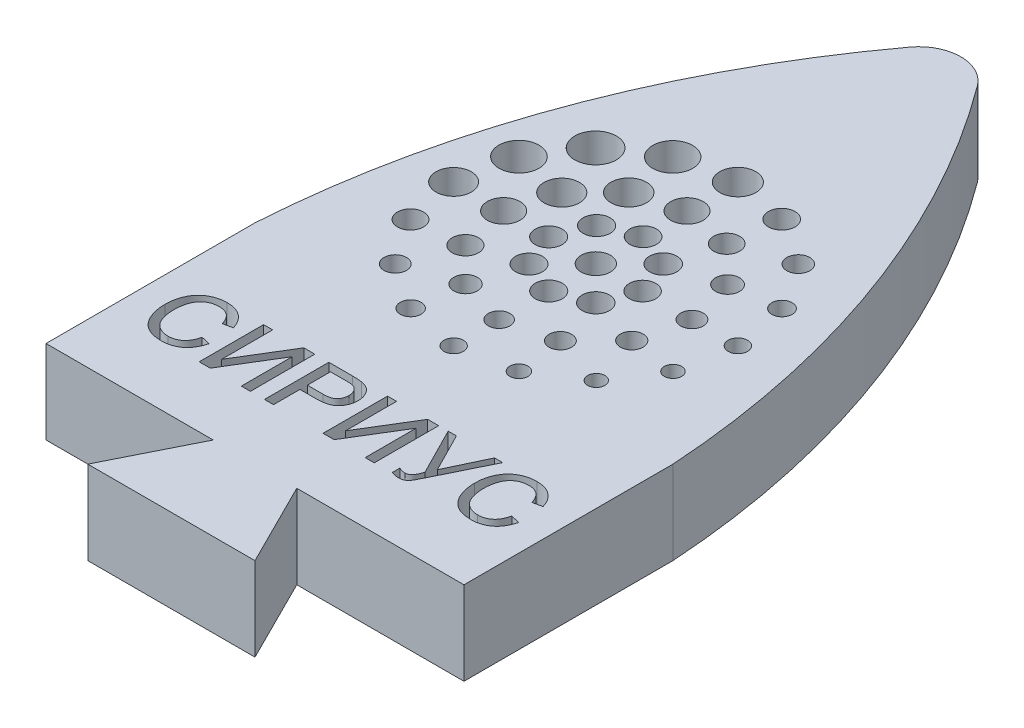
from build123d import *

# Parameters (mm, degrees)
EXTRUDE_1_DEPTH          = 4
CUT_EXTRUDE_4_DEPTH      = 25.046829313
CUT_EXTRUDE_4_DEPTH_BACK = 5
SKETCH_2_R               = 0.955346336
SKETCH_2_R_2             = 0.995187632
SKETCH_2_R_3             = 0.95972743
SKETCH_2_R_4             = 0.84496394
SKETCH_2_R_5             = 0.623664085
SKETCH_2_R_6             = 0.538888272
SKETCH_2_R_7             = 0.498771662
SKETCH_2_R_8             = 0.463561902
SKETCH_2_R_9             = 0.432031543
SKETCH_2_R_10            = 0.412546918
SKETCH_2_R_11            = 0.415667828
SKETCH_2_R_12            = 0.865172281
SKETCH_2_R_13            = 0.77863015
SKETCH_2_R_14            = 0.639123933
SKETCH_2_R_15            = 0.853330263
SKETCH_2_R_16            = 0.849407331
SKETCH_2_R_17            = 0.780614778
SKETCH_2_R_18            = 0.62832514
SKETCH_2_R_19            = 0.565672329
SKETCH_2_R_20            = 0.517847736
SKETCH_2_R_21            = 0.539418342
SKETCH_2_R_22            = 0.546188933
SKETCH_2_R_23            = 0.486356051
SKETCH_2_R_24            = 0.551213393
SKETCH_2_R_25            = 0.638590497
SKETCH_2_R_26            = 0.621593556
SKETCH_2_R_27            = 0.571746306
SKETCH_2_R_28            = 0.653578262
SKETCH_2_R_29            = 0.647001417
SKETCH_2_R_30            = 0.645142772
SKETCH_2_R_31            = 0.635428444
SKETCH_2_R_32            = 0.699137148
SKETCH_2_R_33            = 0.643930411
SKETCH_2_R_34            = 0.646306722
SKETCH_2_R_35            = 0.651340601
SKETCH_2_R_36            = 0.53900554
SKETCH_2_R_37            = 0.464887305
SKETCH_2_W               = 0.263417301
SKETCH_2_H               = 0.263417301
SKETCH_2_H_2             = 1.501478616
CUT_EXTRUDE_7_DEPTH      = 25.046829313


with BuildPart() as part:
    # Эскиз1 → Бобышка-Вытянуть1 (new body)
    with BuildSketch(Plane(origin=(0, 0, 0), x_dir=(1, 0, 0), z_dir=(0, 1, 0))):
        with BuildLine():
            Line((10, -17.5), (2, -17.5))
            Line((2, -17.5), (4, -21.5))
            Line((4, -21.5), (-4, -21.5))
            Line((-4, -21.5), (-2, -17.5))
            Line((-2, -17.5), (-10, -17.5))
            Line((-10, -17.5), (-10, -7.5))
            ThreePointArc((-10, -7.5), (-7.461085915, 4.585557713), (-1.607525862, 15.459500175))
            ThreePointArc((-1.607525862, 15.459500175), (0, 16.269600766), (1.607525862, 15.459500175))
            ThreePointArc((1.607525862, 15.459500175), (7.461085915, 4.585557713), (10, -7.5))
            Line((10, -7.5), (10, -17.5))
        make_face()
    extrude(amount=EXTRUDE_1_DEPTH)

    # Эскиз2 → Вырез-Вытянуть4 (cut, two sides: drawn at the far end of the back side and taken through both)
    # profile 1 of 66: a face of its own
    with BuildSketch(Plane(origin=(0, 0, 0), x_dir=(1, 0, 0), z_dir=(0, 1, 0)).offset(-CUT_EXTRUDE_4_DEPTH_BACK)):
        with Locations(Location((-2.738159379, 5.225279779, 0), (0, 0, 270))):
            Circle(SKETCH_2_R)
    # profile 2 of 66: a face of its own
    with BuildSketch(Plane(origin=(0, 0, 0), x_dir=(1, 0, 0), z_dir=(0, 1, 0)).offset(-CUT_EXTRUDE_4_DEPTH_BACK)):
        with Locations(Location((-4.953817813, 3.751806979, 0), (0, 0, 270))):
            Circle(SKETCH_2_R_2)
    # profile 3 of 66: a face of its own
    with BuildSketch(Plane(origin=(0, 0, 0), x_dir=(1, 0, 0), z_dir=(0, 1, 0)).offset(-CUT_EXTRUDE_4_DEPTH_BACK)):
        with Locations(Location((-6.424975146, 1.555403194, 0), (0, 0, 270))):
            Circle(SKETCH_2_R_3)
    # profile 4 of 66: a face of its own
    with BuildSketch(Plane(origin=(0, 0, 0), x_dir=(1, 0, 0), z_dir=(0, 1, 0)).offset(-CUT_EXTRUDE_4_DEPTH_BACK)):
        with Locations(Location((-6.942449217, -1.051898005, 0), (0, 0, 270))):
            Circle(SKETCH_2_R_4)
    # profile 5 of 66: a face of its own
    with BuildSketch(Plane(origin=(0, 0, 0), x_dir=(1, 0, 0), z_dir=(0, 1, 0)).offset(-CUT_EXTRUDE_4_DEPTH_BACK)):
        with Locations(Location((-6.417488991, -3.641610853, 0), (0, 0, 270))):
            Circle(SKETCH_2_R_5)
    # profile 6 of 66: a face of its own
    with BuildSketch(Plane(origin=(0, 0, 0), x_dir=(1, 0, 0), z_dir=(0, 1, 0)).offset(-CUT_EXTRUDE_4_DEPTH_BACK)):
        with Locations(Location((-4.940502918, -5.847113528, 0), (0, 0, 270))):
            Circle(SKETCH_2_R_6)
    # profile 7 of 66: a face of its own
    with BuildSketch(Plane(origin=(0, 0, 0), x_dir=(1, 0, 0), z_dir=(0, 1, 0)).offset(-CUT_EXTRUDE_4_DEPTH_BACK)):
        with Locations(Location((-2.732194945, -7.316167566, 0), (0, 0, 270))):
            Circle(SKETCH_2_R_7)
    # profile 8 of 66: a face of its own
    with BuildSketch(Plane(origin=(0, 0, 0), x_dir=(1, 0, 0), z_dir=(0, 1, 0)).offset(-CUT_EXTRUDE_4_DEPTH_BACK)):
        with Locations(Location((-0.148368234, -7.843882751, 0), (0, 0, 270))):
            Circle(SKETCH_2_R_8)
    # profile 9 of 66: a face of its own
    with BuildSketch(Plane(origin=(0, 0, 0), x_dir=(1, 0, 0), z_dir=(0, 1, 0)).offset(-CUT_EXTRUDE_4_DEPTH_BACK)):
        with Locations(Location((2.466029809, -7.337697242, 0), (0, 0, 270))):
            Circle(SKETCH_2_R_9)
    # profile 10 of 66: a face of its own
    with BuildSketch(Plane(origin=(0, 0, 0), x_dir=(1, 0, 0), z_dir=(0, 1, 0)).offset(-CUT_EXTRUDE_4_DEPTH_BACK)):
        with Locations(Location((4.699196116, -5.868118025, 0), (0, 0, 270))):
            Circle(SKETCH_2_R_10)
    # profile 11 of 66: a face of its own
    with BuildSketch(Plane(origin=(0, 0, 0), x_dir=(1, 0, 0), z_dir=(0, 1, 0)).offset(-CUT_EXTRUDE_4_DEPTH_BACK)):
        with Locations(Location((6.158628278, -3.656963685, 0), (0, 0, 270))):
            Circle(SKETCH_2_R_11)
    # profile 12 of 66: a face of its own
    with BuildSketch(Plane(origin=(0, 0, 0), x_dir=(1, 0, 0), z_dir=(0, 1, 0)).offset(-CUT_EXTRUDE_4_DEPTH_BACK)):
        with Locations(Location((-0.135121227, 5.740667954, 0), (0, 0, 270))):
            Circle(SKETCH_2_R_12)
    # profile 13 of 66: a face of its own
    with BuildSketch(Plane(origin=(0, 0, 0), x_dir=(1, 0, 0), z_dir=(0, 1, 0)).offset(-CUT_EXTRUDE_4_DEPTH_BACK)):
        with Locations(Location((-0.155270006, 3.326912847, 0), (0, 0, 270))):
            Circle(SKETCH_2_R_13)
    # profile 14 of 66: a face of its own
    with BuildSketch(Plane(origin=(0, 0, 0), x_dir=(1, 0, 0), z_dir=(0, 1, 0)).offset(-CUT_EXTRUDE_4_DEPTH_BACK)):
        with Locations(Location((-0.138513512, 1.210177379, 0), (0, 0, 270))):
            Circle(SKETCH_2_R_14)
    # profile 15 of 66: a face of its own
    with BuildSketch(Plane(origin=(0, 0, 0), x_dir=(1, 0, 0), z_dir=(0, 1, 0)).offset(-CUT_EXTRUDE_4_DEPTH_BACK)):
        with Locations(Location((-2.314845082, 2.699180845, 0), (0, 0, 270))):
            Circle(SKETCH_2_R_15)
    # profile 16 of 66: a face of its own
    with BuildSketch(Plane(origin=(0, 0, 0), x_dir=(1, 0, 0), z_dir=(0, 1, 0)).offset(-CUT_EXTRUDE_4_DEPTH_BACK)):
        with Locations(Location((-3.911590083, 1.090542101, 0), (0, 0, 270))):
            Circle(SKETCH_2_R_16)
    # profile 17 of 66: a face of its own
    with BuildSketch(Plane(origin=(0, 0, 0), x_dir=(1, 0, 0), z_dir=(0, 1, 0)).offset(-CUT_EXTRUDE_4_DEPTH_BACK)):
        with Locations(Location((-4.545118709, -1.056688052, 0), (0, 0, 270))):
            Circle(SKETCH_2_R_17)
    # profile 18 of 66: a face of its own
    with BuildSketch(Plane(origin=(0, 0, 0), x_dir=(1, 0, 0), z_dir=(0, 1, 0)).offset(-CUT_EXTRUDE_4_DEPTH_BACK)):
        with Locations(Location((-4.035880558, -3.394627136, 0), (0, 0, 270))):
            Circle(SKETCH_2_R_18)
    # profile 19 of 66: a face of its own
    with BuildSketch(Plane(origin=(0, 0, 0), x_dir=(1, 0, 0), z_dir=(0, 1, 0)).offset(-CUT_EXTRUDE_4_DEPTH_BACK)):
        with Locations(Location((-2.421793505, -5.002519093, 0), (0, 0, 270))):
            Circle(SKETCH_2_R_19)
    # profile 20 of 66: a face of its own
    with BuildSketch(Plane(origin=(0, 0, 0), x_dir=(1, 0, 0), z_dir=(0, 1, 0)).offset(-CUT_EXTRUDE_4_DEPTH_BACK)):
        with Locations(Location((-0.145491769, -5.671225856, 0), (0, 0, 270))):
            Circle(SKETCH_2_R_20)
    # profile 21 of 66: a face of its own
    with BuildSketch(Plane(origin=(0, 0, 0), x_dir=(1, 0, 0), z_dir=(0, 1, 0)).offset(-CUT_EXTRUDE_4_DEPTH_BACK)):
        with Locations(Location((2.193015138, -5.079923931, 0), (0, 0, 270))):
            Circle(SKETCH_2_R_21)
    # profile 22 of 66: a face of its own
    with BuildSketch(Plane(origin=(0, 0, 0), x_dir=(1, 0, 0), z_dir=(0, 1, 0)).offset(-CUT_EXTRUDE_4_DEPTH_BACK)):
        with Locations(Location((3.895222374, -3.366797911, 0), (0, 0, 270))):
            Circle(SKETCH_2_R_22)
    # profile 23 of 66: a face of its own
    with BuildSketch(Plane(origin=(0, 0, 0), x_dir=(1, 0, 0), z_dir=(0, 1, 0)).offset(-CUT_EXTRUDE_4_DEPTH_BACK)):
        with Locations(Location((6.160967982, 1.556507328, 0), (0, 0, 270))):
            Circle(SKETCH_2_R_23)
    # profile 24 of 66: a face of its own
    with BuildSketch(Plane(origin=(0, 0, 0), x_dir=(1, 0, 0), z_dir=(0, 1, 0)).offset(-CUT_EXTRUDE_4_DEPTH_BACK)):
        with Locations(Location((4.709709562, 3.788135892, 0), (0, 0, 270))):
            Circle(SKETCH_2_R_24)
    # profile 25 of 66: a face of its own
    with BuildSketch(Plane(origin=(0, 0, 0), x_dir=(1, 0, 0), z_dir=(0, 1, 0)).offset(-CUT_EXTRUDE_4_DEPTH_BACK)):
        with Locations(Location((2.453488366, 5.250841361, 0), (0, 0, 270))):
            Circle(SKETCH_2_R_25)
    # profile 26 of 66: a face of its own
    with BuildSketch(Plane(origin=(0, 0, 0), x_dir=(1, 0, 0), z_dir=(0, 1, 0)).offset(-CUT_EXTRUDE_4_DEPTH_BACK)):
        with Locations(Location((2.152245196, 2.918431121, 0), (0, 0, 270))):
            Circle(SKETCH_2_R_26)
    # profile 27 of 66: a face of its own
    with BuildSketch(Plane(origin=(0, 0, 0), x_dir=(1, 0, 0), z_dir=(0, 1, 0)).offset(-CUT_EXTRUDE_4_DEPTH_BACK)):
        with Locations(Location((3.866101577, 1.246973737, 0), (0, 0, 270))):
            Circle(SKETCH_2_R_27)
    # profile 28 of 66: a face of its own
    with BuildSketch(Plane(origin=(0, 0, 0), x_dir=(1, 0, 0), z_dir=(0, 1, 0)).offset(-CUT_EXTRUDE_4_DEPTH_BACK)):
        with Locations(Location((1.473684246, 0.560936887, 0), (0, 0, 270))):
            Circle(SKETCH_2_R_28)
    # profile 29 of 66: a face of its own
    with BuildSketch(Plane(origin=(0, 0, 0), x_dir=(1, 0, 0), z_dir=(0, 1, 0)).offset(-CUT_EXTRUDE_4_DEPTH_BACK)):
        with Locations(Location((-1.713397509, 0.558679288, 0), (0, 0, 270))):
            Circle(SKETCH_2_R_29)
    # profile 30 of 66: a face of its own
    with BuildSketch(Plane(origin=(0, 0, 0), x_dir=(1, 0, 0), z_dir=(0, 1, 0)).offset(-CUT_EXTRUDE_4_DEPTH_BACK)):
        with Locations(Location((-2.39121397, -1.05586942, 0), (0, 0, 270))):
            Circle(SKETCH_2_R_30)
    # profile 31 of 66: a face of its own
    with BuildSketch(Plane(origin=(0, 0, 0), x_dir=(1, 0, 0), z_dir=(0, 1, 0)).offset(-CUT_EXTRUDE_4_DEPTH_BACK)):
        with Locations(Location((2.101773243, -1.054168573, 0), (0, 0, 270))):
            Circle(SKETCH_2_R_31)
    # profile 32 of 66: a face of its own
    with BuildSketch(Plane(origin=(0, 0, 0), x_dir=(1, 0, 0), z_dir=(0, 1, 0)).offset(-CUT_EXTRUDE_4_DEPTH_BACK)):
        with Locations(Location((-0.15304047, -1.038559122, 0), (0, 0, 270))):
            Circle(SKETCH_2_R_32)
    # profile 33 of 66: a face of its own
    with BuildSketch(Plane(origin=(0, 0, 0), x_dir=(1, 0, 0), z_dir=(0, 1, 0)).offset(-CUT_EXTRUDE_4_DEPTH_BACK)):
        with Locations(Location((-1.734344502, -2.654102095, 0), (0, 0, 270))):
            Circle(SKETCH_2_R_33)
    # profile 34 of 66: a face of its own
    with BuildSketch(Plane(origin=(0, 0, 0), x_dir=(1, 0, 0), z_dir=(0, 1, 0)).offset(-CUT_EXTRUDE_4_DEPTH_BACK)):
        with Locations(Location((-0.147112945, -3.297353782, 0), (0, 0, 270))):
            Circle(SKETCH_2_R_34)
    # profile 35 of 66: a face of its own
    with BuildSketch(Plane(origin=(0, 0, 0), x_dir=(1, 0, 0), z_dir=(0, 1, 0)).offset(-CUT_EXTRUDE_4_DEPTH_BACK)):
        with Locations(Location((1.468433392, -2.660802889, 0), (0, 0, 270))):
            Circle(SKETCH_2_R_35)
    # profile 36 of 66: a face of its own
    with BuildSketch(Plane(origin=(0, 0, 0), x_dir=(1, 0, 0), z_dir=(0, 1, 0)).offset(-CUT_EXTRUDE_4_DEPTH_BACK)):
        with Locations(Location((4.463469489, -1.053929521, 0), (0, 0, 270))):
            Circle(SKETCH_2_R_36)
    # profile 37 of 66: a face of its own
    with BuildSketch(Plane(origin=(0, 0, 0), x_dir=(1, 0, 0), z_dir=(0, 1, 0)).offset(-CUT_EXTRUDE_4_DEPTH_BACK)):
        with Locations(Location((6.650551249, -1.043853133, 0), (0, 0, 270))):
            Circle(SKETCH_2_R_37)
    # profile 38 of 66: a face of its own
    with BuildSketch(Plane(origin=(0, 0, 0), x_dir=(1, 0, 0), z_dir=(0, 1, 0)).offset(-CUT_EXTRUDE_4_DEPTH_BACK)):
        with BuildLine():
            Line((-9.052179694, 89.261227092), (-9.052179694, 91.31588204))
            Line((-9.052179694, 91.31588204), (-8.788762393, 91.31588204))
            Line((-8.788762393, 91.31588204), (-8.788762393, 90.565554322))
            add(Edge.make_bspline(
                [(-8.788762393, 90.565554322), (-8.774175171, 90.583312264), (-8.745531158, 90.618182422), (-8.697206371, 90.663737928), (-8.646197641, 90.702735749), (-8.591907827, 90.7338792), (-8.535258092, 90.759189069), (-8.475345618, 90.776122077), (-8.412864663, 90.787481982), (-8.370090632, 90.788520086), (-8.348361593, 90.789047438)],
                knots=[0, 0, 0, 0, 1.075179344, 2.11126231, 3.101893549, 4.07484835, 5.035680757, 5.999322527, 6.983663715, 8, 8, 8, 8], degree=3))
            add(Edge.make_bspline(
                [(-8.348361593, 90.789047438), (-8.321962348, 90.788332196), (-8.270777231, 90.786945424), (-8.196776189, 90.774069475), (-8.127754133, 90.754339372), (-8.064885954, 90.725357112), (-8.008613764, 90.689833717), (-7.960421814, 90.647251489), (-7.920839781, 90.59836861), (-7.895638689, 90.552104748), (-7.879146326, 90.511895396), (-7.86917459, 90.477854402), (-7.860097248, 90.440943049), (-7.852548207, 90.400710305), (-7.847587861, 90.357084682), (-7.843356868, 90.310299255), (-7.840897656, 90.260180937), (-7.840609351, 90.225721162), (-7.840460109, 90.207883017)],
                knots=[0, 0, 0, 0, 1.423572297, 2.760143949, 4.041704725, 5.287516156, 6.482931736, 7.621116371, 8.742804, 9.859691372, 10.450931907, 11.085684043, 11.77170108, 12.502189623, 13.292936877, 14.140280139, 15.037313705, 16, 16, 16, 16], degree=3))
            Line((-7.840460109, 90.207883017), (-7.840460109, 89.261227092))
            Line((-7.840460109, 89.261227092), (-8.10387741, 89.261227092))
            Line((-8.10387741, 89.261227092), (-8.10387741, 90.194300563))
            add(Edge.make_bspline(
                [(-8.10387741, 90.194300563), (-8.104096961, 90.209400299), (-8.10452081, 90.238550784), (-8.108243834, 90.280631602), (-8.114344409, 90.319578243), (-8.122912817, 90.3553949), (-8.133829543, 90.388236903), (-8.14798486, 90.417485936), (-8.164094288, 90.443825785), (-8.182721382, 90.467118587), (-8.203834775, 90.487161488), (-8.226671989, 90.50491537), (-8.251970271, 90.519067632), (-8.279040884, 90.531249927), (-8.308284878, 90.540720607), (-8.339643375, 90.547048883), (-8.372932414, 90.551460262), (-8.395815971, 90.551797668), (-8.407630485, 90.551971867)],
                knots=[0, 0, 0, 0, 1.348466509, 2.603254179, 3.769725567, 4.866462031, 5.889525116, 6.854190675, 7.762162134, 8.642507241, 9.509185433, 10.357210019, 11.219023099, 12.091228191, 13.005791182, 13.957527608, 14.945495211, 16, 16, 16, 16], degree=3))
            add(Edge.make_bspline(
                [(-8.407630485, 90.551971867), (-8.425521355, 90.55125038), (-8.460941216, 90.549821999), (-8.513316233, 90.538578855), (-8.563974778, 90.520455991), (-8.612280274, 90.495402351), (-8.65666872, 90.464649488), (-8.694598592, 90.427594257), (-8.725415874, 90.385366018), (-8.750024584, 90.337561901), (-8.767427585, 90.28226633), (-8.779927442, 90.218649262), (-8.78765441, 90.145783359), (-8.788379558, 90.094030349), (-8.788762393, 90.066707808)],
                knots=[0, 0, 0, 0, 0.917620555, 1.816680451, 2.736567805, 3.671956967, 4.601896568, 5.4982222, 6.379906244, 7.274321234, 8.245216896, 9.344499276, 10.598052048, 12, 12, 12, 12], degree=3))
            Line((-8.788762393, 90.066707808), (-8.788762393, 89.261227092))
            Line((-8.788762393, 89.261227092), (-9.052179694, 89.261227092))
        make_face()
    # profile 39 of 66: a face of its own
    with BuildSketch(Plane(origin=(0, 0, 0), x_dir=(1, 0, 0), z_dir=(0, 1, 0)).offset(-CUT_EXTRUDE_4_DEPTH_BACK)):
        with BuildLine():
            Line((-6.918499556, 89.478546365), (-6.892157826, 89.257522786))
            add(Edge.make_bspline(
                [(-6.892157826, 89.257522786), (-6.90900088, 89.254043161), (-6.94160096, 89.247308273), (-6.989449114, 89.240580902), (-7.03445659, 89.235441328), (-7.063639874, 89.235066862), (-7.077784705, 89.234885362)],
                knots=[0, 0, 0, 0, 1.101333134, 2.13165308, 3.094431941, 4, 4, 4, 4], degree=3))
            add(Edge.make_bspline(
                [(-7.077784705, 89.234885362), (-7.098797424, 89.235458625), (-7.138513939, 89.23654216), (-7.194578953, 89.243971874), (-7.243210772, 89.257456372), (-7.2848134, 89.276002098), (-7.319357329, 89.299453458), (-7.348420973, 89.326218193), (-7.371949262, 89.356350555), (-7.387539895, 89.384711875), (-7.396717702, 89.411147505), (-7.40278283, 89.435798636), (-7.407417396, 89.46544159), (-7.412046141, 89.499577369), (-7.415287975, 89.538726947), (-7.416978653, 89.582533486), (-7.418954034, 89.631229879), (-7.418979226, 89.665268278), (-7.418992428, 89.683106363)],
                knots=[0, 0, 0, 0, 1.515965932, 2.865354161, 4.068592833, 5.144966063, 6.135994557, 7.067504024, 7.984224584, 8.88319335, 9.387210378, 9.999362939, 10.71208193, 11.550605788, 12.484373718, 13.544606854, 14.713232298, 16, 16, 16, 16], degree=3))
            Line((-7.418992428, 89.683106363), (-7.418992428, 90.525630137))
            Line((-7.418992428, 90.525630137), (-7.603384538, 90.525630137))
            Line((-7.603384538, 90.525630137), (-7.603384538, 90.762705708))
            Line((-7.603384538, 90.762705708), (-7.418992428, 90.762705708))
            Line((-7.418992428, 90.762705708), (-7.418992428, 91.128197213))
            Line((-7.418992428, 91.128197213), (-7.155575127, 91.278015803))
            Line((-7.155575127, 91.278015803), (-7.155575127, 90.762705708))
            Line((-7.155575127, 90.762705708), (-6.918499556, 90.762705708))
            Line((-6.918499556, 90.762705708), (-6.918499556, 90.525630137))
            Line((-6.918499556, 90.525630137), (-7.155575127, 90.525630137))
            Line((-7.155575127, 90.525630137), (-7.155575127, 89.673639804))
            add(Edge.make_bspline(
                [(-7.155575127, 89.673639804), (-7.155474134, 89.657582363), (-7.155291848, 89.628599706), (-7.152778834, 89.589867554), (-7.149674606, 89.560454823), (-7.143140447, 89.53382337), (-7.127865613, 89.509670209), (-7.10748671, 89.49134201), (-7.086790746, 89.480965703), (-7.067601766, 89.475969145), (-7.045658972, 89.472639892), (-7.030054928, 89.472195686), (-7.021808528, 89.471960933)],
                knots=[0, 0, 0, 0, 1.693748017, 3.05710712, 4.093010578, 4.8128101, 5.929870973, 7.047775512, 7.662723095, 8.354621928, 9.130453249, 10, 10, 10, 10], degree=3))
            add(Edge.make_bspline(
                [(-7.021808528, 89.471960933), (-7.014810069, 89.472052171), (-6.999706452, 89.472249074), (-6.975417318, 89.473600231), (-6.947970276, 89.475628965), (-6.928648267, 89.477541712), (-6.918499556, 89.478546365)],
                knots=[0, 0, 0, 0, 0.810958033, 1.750156657, 2.818290096, 4, 4, 4, 4], degree=3))
        make_face()
    # profile 40 of 66: a face of its own
    with BuildSketch(Plane(origin=(0, 0, 0), x_dir=(1, 0, 0), z_dir=(0, 1, 0)).offset(-CUT_EXTRUDE_4_DEPTH_BACK)):
        with BuildLine():
            Line((-6.128247653, 89.478546365), (-6.101905922, 89.257522786))
            add(Edge.make_bspline(
                [(-6.101905922, 89.257522786), (-6.118748977, 89.254043161), (-6.151349057, 89.247308273), (-6.199197211, 89.240580902), (-6.244204687, 89.235441328), (-6.273387971, 89.235066862), (-6.287532802, 89.234885362)],
                knots=[0, 0, 0, 0, 1.101333134, 2.13165308, 3.094431941, 4, 4, 4, 4], degree=3))
            add(Edge.make_bspline(
                [(-6.287532802, 89.234885362), (-6.308545521, 89.235458625), (-6.348262036, 89.23654216), (-6.40432705, 89.243971874), (-6.452958869, 89.257456372), (-6.494561497, 89.276002098), (-6.529105426, 89.299453458), (-6.55816907, 89.326218193), (-6.581697359, 89.356350555), (-6.597287992, 89.384711875), (-6.606465799, 89.411147505), (-6.612530927, 89.435798636), (-6.617165492, 89.46544159), (-6.621794238, 89.499577369), (-6.625036072, 89.538726947), (-6.62672675, 89.582533486), (-6.628702131, 89.631229879), (-6.628727323, 89.665268278), (-6.628740524, 89.683106363)],
                knots=[0, 0, 0, 0, 1.515965932, 2.865354161, 4.068592833, 5.144966063, 6.135994557, 7.067504024, 7.984224584, 8.88319335, 9.387210378, 9.999362939, 10.71208193, 11.550605788, 12.484373718, 13.544606854, 14.713232298, 16, 16, 16, 16], degree=3))
            Line((-6.628740524, 89.683106363), (-6.628740524, 90.525630137))
            Line((-6.628740524, 90.525630137), (-6.813132635, 90.525630137))
            Line((-6.813132635, 90.525630137), (-6.813132635, 90.762705708))
            Line((-6.813132635, 90.762705708), (-6.628740524, 90.762705708))
            Line((-6.628740524, 90.762705708), (-6.628740524, 91.128197213))
            Line((-6.628740524, 91.128197213), (-6.365323223, 91.278015803))
            Line((-6.365323223, 91.278015803), (-6.365323223, 90.762705708))
            Line((-6.365323223, 90.762705708), (-6.128247653, 90.762705708))
            Line((-6.128247653, 90.762705708), (-6.128247653, 90.525630137))
            Line((-6.128247653, 90.525630137), (-6.365323223, 90.525630137))
            Line((-6.365323223, 90.525630137), (-6.365323223, 89.673639804))
            add(Edge.make_bspline(
                [(-6.365323223, 89.673639804), (-6.365222231, 89.657582363), (-6.365039945, 89.628599706), (-6.362526931, 89.589867554), (-6.359422703, 89.560454823), (-6.352888544, 89.53382337), (-6.33761371, 89.509670209), (-6.317234807, 89.49134201), (-6.296538842, 89.480965703), (-6.277349863, 89.475969145), (-6.255407069, 89.472639892), (-6.239803025, 89.472195686), (-6.231556625, 89.471960933)],
                knots=[0, 0, 0, 0, 1.693748017, 3.05710712, 4.093010578, 4.8128101, 5.929870973, 7.047775512, 7.662723095, 8.354621928, 9.130453249, 10, 10, 10, 10], degree=3))
            add(Edge.make_bspline(
                [(-6.231556625, 89.471960933), (-6.224558166, 89.472052171), (-6.209454549, 89.472249074), (-6.185165415, 89.473600231), (-6.157718373, 89.475628965), (-6.138396364, 89.477541712), (-6.128247653, 89.478546365)],
                knots=[0, 0, 0, 0, 0.810958033, 1.750156657, 2.818290096, 4, 4, 4, 4], degree=3))
        make_face()
    # profile 41 of 66: a face of its own
    with BuildSketch(Plane(origin=(0, 0, 0), x_dir=(1, 0, 0), z_dir=(0, 1, 0)).offset(-CUT_EXTRUDE_4_DEPTH_BACK)):
        with BuildLine():
            Line((-5.891172082, 88.70805076), (-5.891172082, 90.762705708))
            Line((-5.891172082, 90.762705708), (-5.627754781, 90.762705708))
            Line((-5.627754781, 90.762705708), (-5.627754781, 90.524395368))
            add(Edge.make_bspline(
                [(-5.627754781, 90.524395368), (-5.614543063, 90.545361968), (-5.589092577, 90.585751127), (-5.546225979, 90.640254185), (-5.500226609, 90.685861068), (-5.451565956, 90.723946156), (-5.398322536, 90.753137734), (-5.340430517, 90.774428289), (-5.277058615, 90.786858525), (-5.233096096, 90.788302216), (-5.210402994, 90.789047438)],
                knots=[0, 0, 0, 0, 1.141868254, 2.199646056, 3.187916027, 4.121412168, 5.038483649, 5.974824485, 6.95462054, 8, 8, 8, 8], degree=3))
            add(Edge.make_bspline(
                [(-5.210402994, 90.789047438), (-5.195299479, 90.788711122), (-5.165436687, 90.788046156), (-5.121298707, 90.783358374), (-5.078329677, 90.776091365), (-5.036730298, 90.765414103), (-4.996723178, 90.751349864), (-4.958170133, 90.734211008), (-4.920651757, 90.71467995), (-4.884836596, 90.691482862), (-4.85091859, 90.665532527), (-4.818409183, 90.637672829), (-4.788900881, 90.606364255), (-4.760778812, 90.573235529), (-4.735207542, 90.537277156), (-4.712148986, 90.498584267), (-4.690751844, 90.457727249), (-4.665557153, 90.399481956), (-4.63880033, 90.323079635), (-4.617054664, 90.226662211), (-4.602874304, 90.126260194), (-4.601251662, 90.057839364), (-4.600427307, 90.023079317)],
                knots=[0, 0, 0, 0, 0.824202902, 1.629620634, 2.419929953, 3.200854495, 3.970497378, 4.731532444, 5.501903467, 6.276628953, 7.056871135, 7.831705169, 8.610184821, 9.402088757, 10.202023236, 11.014889876, 11.858855485, 12.71721399, 14.476656902, 16.267557585, 18.103795699, 20, 20, 20, 20], degree=3))
            add(Edge.make_bspline(
                [(-4.600427307, 90.023079317), (-4.601298877, 89.985981655), (-4.603004589, 89.913379481), (-4.618642511, 89.807278665), (-4.644070931, 89.706828329), (-4.673711079, 89.627582888), (-4.70212355, 89.567973765), (-4.726212375, 89.526332803), (-4.752042791, 89.487186024), (-4.780165181, 89.450529534), (-4.81115954, 89.4169596), (-4.844013175, 89.385574924), (-4.879154488, 89.356941538), (-4.928738671, 89.323459548), (-4.993295244, 89.288393984), (-5.073975251, 89.257319272), (-5.156998918, 89.238566705), (-5.213191732, 89.236112012), (-5.241272209, 89.234885362)],
                knots=[0, 0, 0, 0, 1.566750505, 3.066217315, 4.520030908, 5.938083948, 6.632957415, 7.30813415, 7.968947793, 8.613647255, 9.257851326, 9.897527079, 10.532192309, 11.170526994, 12.423402314, 13.627070148, 14.814207778, 16, 16, 16, 16], degree=3))
            add(Edge.make_bspline(
                [(-5.241272209, 89.234885362), (-5.261642595, 89.2355064), (-5.301492939, 89.236721329), (-5.359563869, 89.248990723), (-5.414687713, 89.267515491), (-5.465686589, 89.294875922), (-5.512843999, 89.327290231), (-5.55574796, 89.364118267), (-5.594642026, 89.404620748), (-5.616687247, 89.434656178), (-5.627754781, 89.449735098)],
                knots=[0, 0, 0, 0, 1.060500719, 2.074645059, 3.081194601, 4.082546779, 5.08044464, 6.05947861, 7.025785017, 8, 8, 8, 8], degree=3))
            Line((-5.627754781, 89.449735098), (-5.627754781, 88.70805076))
            Line((-5.627754781, 88.70805076), (-5.891172082, 88.70805076))
        make_face()
        with BuildLine():
            add(Edge.make_bspline(
                [(-5.627754781, 89.999618714), (-5.627500793, 89.977791868), (-5.627009555, 89.935576435), (-5.621498085, 89.874545694), (-5.613010107, 89.818010729), (-5.601222585, 89.765756257), (-5.585615003, 89.717951772), (-5.5667304, 89.674449903), (-5.544409699, 89.635251142), (-5.518500542, 89.600699162), (-5.489786145, 89.570796075), (-5.460238105, 89.544062627), (-5.42880911, 89.5218219), (-5.396043223, 89.503433632), (-5.361627071, 89.489299216), (-5.325642621, 89.47962657), (-5.288429635, 89.473079228), (-5.263114629, 89.47233624), (-5.250327179, 89.471960933)],
                knots=[0, 0, 0, 0, 1.437434546, 2.78015081, 4.032764778, 5.2012756, 6.304456418, 7.34047555, 8.320212436, 9.269161424, 10.176980179, 11.047598006, 11.89018243, 12.707424221, 13.518042872, 14.333683991, 15.158288469, 16, 16, 16, 16], degree=3))
            add(Edge.make_bspline(
                [(-5.250327179, 89.471960933), (-5.237272771, 89.472361255), (-5.211426971, 89.473153833), (-5.173352045, 89.479328334), (-5.137046439, 89.490301791), (-5.10190917, 89.5046385), (-5.068687655, 89.523972084), (-5.036172758, 89.546490884), (-5.005820018, 89.574133796), (-4.976405782, 89.605250734), (-4.949561224, 89.641087873), (-4.926464586, 89.681779746), (-4.907250401, 89.727029891), (-4.891127362, 89.776578114), (-4.878992257, 89.830905505), (-4.87002281, 89.889613386), (-4.864608651, 89.953007395), (-4.864105343, 89.99672658), (-4.863844608, 90.019375011)],
                knots=[0, 0, 0, 0, 0.83316913, 1.649551805, 2.453198062, 3.250183293, 4.066002037, 4.901882611, 5.770302609, 6.681184977, 7.632314019, 8.620852534, 9.660448002, 10.765528849, 11.942537832, 13.209677882, 14.554492318, 16, 16, 16, 16], degree=3))
            add(Edge.make_bspline(
                [(-4.863844608, 90.019375011), (-4.864103751, 90.040927086), (-4.864606398, 90.082730676), (-4.870082062, 90.143218433), (-4.878687433, 90.199592741), (-4.890325027, 90.251873036), (-4.905977894, 90.300008596), (-4.925384685, 90.343813462), (-4.948006569, 90.383643898), (-4.974058821, 90.419078576), (-5.002342573, 90.450248262), (-5.032335802, 90.477311951), (-5.06337556, 90.500419875), (-5.096050046, 90.519141119), (-5.129837449, 90.534301056), (-5.165362717, 90.544319752), (-5.202066547, 90.550867295), (-5.226974885, 90.551599818), (-5.239625851, 90.551971867)],
                knots=[0, 0, 0, 0, 1.417753527, 2.749952742, 3.99222208, 5.168205227, 6.27013346, 7.316877701, 8.315654914, 9.278031164, 10.204687429, 11.080340169, 11.932552405, 12.745464952, 13.553904146, 14.362393741, 15.168258362, 16, 16, 16, 16], degree=3))
            add(Edge.make_bspline(
                [(-5.239625851, 90.551971867), (-5.252277713, 90.551616292), (-5.277346759, 90.550911739), (-5.314269455, 90.544046132), (-5.349967092, 90.532937408), (-5.384331004, 90.516946317), (-5.417910165, 90.49706597), (-5.45049091, 90.472809084), (-5.481413272, 90.443465905), (-5.511391003, 90.410461652), (-5.538955408, 90.373111085), (-5.562981076, 90.331577036), (-5.583139626, 90.286012671), (-5.599547304, 90.236371946), (-5.612223192, 90.182783303), (-5.621020112, 90.125243082), (-5.627123243, 90.063820252), (-5.62754004, 90.021449016), (-5.627754781, 89.999618714)],
                knots=[0, 0, 0, 0, 0.806892931, 1.598819005, 2.388223016, 3.187667544, 4.012236564, 4.875742748, 5.774202643, 6.729148108, 7.718801443, 8.731210163, 9.785807378, 10.893572366, 12.063989118, 13.296455458, 14.607092894, 16, 16, 16, 16], degree=3))
        make_face(mode=Mode.SUBTRACT)
    # profile 42 of 66: a face of its own
    with BuildSketch(Plane(origin=(0, 0, 0), x_dir=(1, 0, 0), z_dir=(0, 1, 0)).offset(-CUT_EXTRUDE_4_DEPTH_BACK)):
        with BuildLine():
            Line((-4.389693466, 89.735378234), (-4.126276165, 89.761719964))
            add(Edge.make_bspline(
                [(-4.126276165, 89.761719964), (-4.122252685, 89.739427589), (-4.114547017, 89.696733791), (-4.090880602, 89.637895516), (-4.058949871, 89.587007963), (-4.024556224, 89.55155971), (-3.992569741, 89.5287215), (-3.966555357, 89.513213741), (-3.93795807, 89.500690372), (-3.907476708, 89.489856035), (-3.874675574, 89.481646328), (-3.839569235, 89.475941786), (-3.802140343, 89.472742872), (-3.776430991, 89.472225897), (-3.763254197, 89.471960933)],
                knots=[0, 0, 0, 0, 1.576426584, 3.019132651, 4.39139761, 5.744583744, 6.429748217, 7.128801231, 7.852561526, 8.603024018, 9.382742032, 10.206978913, 11.081024327, 12, 12, 12, 12], degree=3))
            add(Edge.make_bspline(
                [(-3.763254197, 89.471960933), (-3.750073949, 89.472029241), (-3.72449119, 89.472161828), (-3.687550791, 89.475731393), (-3.653146873, 89.480476631), (-3.621437072, 89.487336174), (-3.592487482, 89.496570487), (-3.565780995, 89.507035345), (-3.542008609, 89.52026852), (-3.514449021, 89.539682283), (-3.486033776, 89.56717747), (-3.460089595, 89.603648387), (-3.444151933, 89.643740133), (-3.442314618, 89.671582375), (-3.441391182, 89.6855759)],
                knots=[0, 0, 0, 0, 1.101207713, 2.137435615, 3.099211963, 4.003546554, 4.845050796, 5.637285753, 6.396976949, 7.112904354, 8.451176697, 9.67915534, 10.8335422, 12, 12, 12, 12], degree=3))
            add(Edge.make_bspline(
                [(-3.441391182, 89.6855759), (-3.441539873, 89.691921497), (-3.441831731, 89.704376882), (-3.446762, 89.722223847), (-3.453766741, 89.739092075), (-3.463874228, 89.754875589), (-3.476679285, 89.769636617), (-3.492285895, 89.783494211), (-3.510724792, 89.796119602), (-3.524451043, 89.803294775), (-3.53152929, 89.806994813)],
                knots=[0, 0, 0, 0, 0.948511305, 1.861774925, 2.756066261, 3.680846901, 4.658374041, 5.678500434, 6.80286706, 8, 8, 8, 8], degree=3))
            add(Edge.make_bspline(
                [(-3.53152929, 89.806994813), (-3.53740071, 89.809669438), (-3.550230507, 89.815513832), (-3.571814237, 89.823461174), (-3.596858966, 89.832846156), (-3.626066945, 89.841413007), (-3.658789592, 89.851495406), (-3.69531, 89.862350478), (-3.735967976, 89.872654603), (-3.764221077, 89.880096851), (-3.778894599, 89.883962055)],
                knots=[0, 0, 0, 0, 0.596822396, 1.30413245, 2.127382897, 3.071041962, 4.119245502, 5.296370109, 6.595843667, 8, 8, 8, 8], degree=3))
            add(Edge.make_bspline(
                [(-3.778894599, 89.883962055), (-3.79893579, 89.889826038), (-3.837554997, 89.901125883), (-3.893121787, 89.918004142), (-3.944459735, 89.934117223), (-3.99160234, 89.949537297), (-4.03433133, 89.964867661), (-4.072859666, 89.979147475), (-4.106925516, 89.993269387), (-4.14643813, 90.010128736), (-4.189918423, 90.033850002), (-4.235914329, 90.067321108), (-4.274839077, 90.106386018), (-4.307129745, 90.149786959), (-4.332476531, 90.196933194), (-4.35002222, 90.247113797), (-4.361239059, 90.299586415), (-4.362640971, 90.3354188), (-4.363351736, 90.353585712)],
                knots=[0, 0, 0, 0, 1.22605552, 2.362598816, 3.409724438, 4.385374865, 5.274589806, 6.075051486, 6.797583358, 7.439654886, 8.596878446, 9.697305961, 10.768176168, 11.821850251, 12.863383541, 13.897821176, 14.934201653, 16, 16, 16, 16], degree=3))
            add(Edge.make_bspline(
                [(-4.363351736, 90.353585712), (-4.36278207, 90.370084781), (-4.361654552, 90.402740804), (-4.353151435, 90.450671551), (-4.339610727, 90.49691298), (-4.320059252, 90.540842151), (-4.296108307, 90.582294676), (-4.267173145, 90.619857503), (-4.235346896, 90.654630983), (-4.210667646, 90.673984955), (-4.198304333, 90.683680517)],
                knots=[0, 0, 0, 0, 1.034021226, 2.046601578, 3.042752055, 4.048071569, 5.054273975, 6.036661087, 7.016446045, 8, 8, 8, 8], degree=3))
            add(Edge.make_bspline(
                [(-4.198304333, 90.683680517), (-4.188000045, 90.69086949), (-4.166410446, 90.705931864), (-4.129922488, 90.725641415), (-4.088048718, 90.74316534), (-4.041683031, 90.75886552), (-3.991927612, 90.772680969), (-3.939673815, 90.781798237), (-3.885774889, 90.787849152), (-3.849293448, 90.788643685), (-3.83075488, 90.789047438)],
                knots=[0, 0, 0, 0, 0.776203524, 1.626305774, 2.557252601, 3.57906176, 4.650888526, 5.745456612, 6.854321437, 8, 8, 8, 8], degree=3))
            add(Edge.make_bspline(
                [(-3.83075488, 90.789047438), (-3.803151997, 90.788413389), (-3.749559577, 90.78718235), (-3.671800079, 90.777737876), (-3.599313202, 90.761659996), (-3.532483597, 90.739743435), (-3.472381504, 90.712340837), (-3.419738791, 90.680438571), (-3.376024255, 90.642989964), (-3.339966273, 90.600799082), (-3.311054644, 90.552395617), (-3.287915434, 90.497300647), (-3.269311231, 90.435023575), (-3.261224758, 90.390727313), (-3.256999072, 90.367579756)],
                knots=[0, 0, 0, 0, 1.253394935, 2.433530808, 3.550681177, 4.620594829, 5.621516506, 6.544862206, 7.406547904, 8.22431151, 9.054607538, 9.956211395, 10.931993099, 12, 12, 12, 12], degree=3))
            Line((-3.256999072, 90.367579756), (-3.520416373, 90.341238026))
            add(Edge.make_bspline(
                [(-3.520416373, 90.341238026), (-3.523550204, 90.357036632), (-3.529631001, 90.387691799), (-3.548041309, 90.430126882), (-3.57418394, 90.46665755), (-3.607384061, 90.497666098), (-3.647773747, 90.522731748), (-3.696051252, 90.539716506), (-3.751241557, 90.550606926), (-3.790635224, 90.551500582), (-3.811410172, 90.551971867)],
                knots=[0, 0, 0, 0, 0.971549383, 1.88516682, 2.771115596, 3.668786025, 4.614654303, 5.622170142, 6.746009326, 8, 8, 8, 8], degree=3))
            add(Edge.make_bspline(
                [(-3.811410172, 90.551971867), (-3.823898614, 90.551823328), (-3.847941429, 90.55153736), (-3.882716289, 90.549095668), (-3.914685361, 90.544876649), (-3.944128932, 90.539929406), (-3.970427837, 90.532273612), (-3.994344744, 90.523867179), (-4.015213341, 90.51310312), (-4.03888111, 90.497684504), (-4.062430767, 90.4753598), (-4.084438808, 90.446368292), (-4.097565144, 90.414019898), (-4.099144967, 90.391561777), (-4.099934435, 90.380339032)],
                knots=[0, 0, 0, 0, 1.202032812, 2.314159929, 3.352655878, 4.305866621, 5.183839704, 5.986040797, 6.742017283, 7.437935182, 8.699432998, 9.843179159, 10.922196019, 12, 12, 12, 12], degree=3))
            add(Edge.make_bspline(
                [(-4.099934435, 90.380339032), (-4.099669534, 90.373165574), (-4.09914714, 90.359019261), (-4.093427488, 90.338600625), (-4.084743695, 90.319231588), (-4.07654292, 90.307640529), (-4.072357936, 90.301725431)],
                knots=[0, 0, 0, 0, 1.012137305, 1.99597066, 2.977312565, 4, 4, 4, 4], degree=3))
            add(Edge.make_bspline(
                [(-4.072357936, 90.301725431), (-4.067340282, 90.295762625), (-4.056899082, 90.283354664), (-4.03645091, 90.267917678), (-4.012657177, 90.253411227), (-3.994816249, 90.245670172), (-3.985512545, 90.241633359)],
                knots=[0, 0, 0, 0, 0.873299099, 1.81724178, 2.861733162, 4, 4, 4, 4], degree=3))
            add(Edge.make_bspline(
                [(-3.985512545, 90.241633359), (-3.98195287, 90.240376126), (-3.97364657, 90.237442442), (-3.958906934, 90.232953393), (-3.940284688, 90.227208084), (-3.917326589, 90.22063889), (-3.890473591, 90.212825047), (-3.859287545, 90.204193401), (-3.82420163, 90.194321506), (-3.799342334, 90.187558261), (-3.786303211, 90.184010825)],
                knots=[0, 0, 0, 0, 0.436802817, 1.019254657, 1.782618184, 2.69198815, 3.782349451, 5.018834001, 6.436327698, 8, 8, 8, 8], degree=3))
            add(Edge.make_bspline(
                [(-3.786303211, 90.184010825), (-3.766947275, 90.178147751), (-3.729567478, 90.166825101), (-3.675427202, 90.149778791), (-3.625022145, 90.133894402), (-3.578497778, 90.118699503), (-3.535885389, 90.104125233), (-3.49697991, 90.090762206), (-3.461895262, 90.077881139), (-3.420742602, 90.062460569), (-3.373989115, 90.041681638), (-3.324383826, 90.010174273), (-3.280902013, 89.973591333), (-3.244004906, 89.931903027), (-3.214025022, 89.884761003), (-3.193259473, 89.831802706), (-3.179974448, 89.77375828), (-3.178655524, 89.733259631), (-3.177973881, 89.71232922)],
                knots=[0, 0, 0, 0, 1.155996739, 2.232437775, 3.244329082, 4.176768736, 5.029854173, 5.818511279, 6.528027969, 7.165934889, 8.330913826, 9.444808892, 10.513164249, 11.568838208, 12.615385132, 13.688622127, 14.805439433, 16, 16, 16, 16], degree=3))
            add(Edge.make_bspline(
                [(-3.177973881, 89.71232922), (-3.178827709, 89.691261412), (-3.180530998, 89.649233515), (-3.194846285, 89.587459923), (-3.217175779, 89.527346581), (-3.248871748, 89.470141462), (-3.288755963, 89.416666847), (-3.337458127, 89.369446515), (-3.394266888, 89.328724177), (-3.458410956, 89.295084541), (-3.52842413, 89.267568528), (-3.603807066, 89.249349448), (-3.683384532, 89.236573134), (-3.738093017, 89.235457308), (-3.766135324, 89.234885362)],
                knots=[0, 0, 0, 0, 0.894809563, 1.785044015, 2.682170314, 3.614214614, 4.555721535, 5.508634546, 6.486485836, 7.51727745, 8.581064401, 9.676123613, 10.808834633, 12, 12, 12, 12], degree=3))
            add(Edge.make_bspline(
                [(-3.766135324, 89.234885362), (-3.789196275, 89.235291788), (-3.833884171, 89.236079368), (-3.898812537, 89.241816659), (-3.959519806, 89.251559993), (-4.015963035, 89.265497892), (-4.068173252, 89.283224745), (-4.116298915, 89.304560754), (-4.160235255, 89.33018428), (-4.199958523, 89.359945429), (-4.235727477, 89.393864654), (-4.268275917, 89.43124668), (-4.297236879, 89.472644641), (-4.322242835, 89.517956506), (-4.344663365, 89.566703162), (-4.363494129, 89.619443732), (-4.378760989, 89.676044877), (-4.385991746, 89.715288051), (-4.389693466, 89.735378234)],
                knots=[0, 0, 0, 0, 1.244406412, 2.411431524, 3.514215425, 4.559320282, 5.545040859, 6.48623969, 7.395443761, 8.283912081, 9.158607275, 10.050831307, 10.954592804, 11.879399228, 12.840196462, 13.8472361, 14.897912238, 16, 16, 16, 16], degree=3))
        make_face()
    # profile 43 of 66: a face of its own
    with BuildSketch(Plane(origin=(0, 0, 0), x_dir=(1, 0, 0), z_dir=(0, 1, 0)).offset(-CUT_EXTRUDE_4_DEPTH_BACK)):
        with Locations((-2.67748101, 90.630997057)):
            Rectangle(SKETCH_2_W, SKETCH_2_H)
    # profile 44 of 66: a face of its own
    with BuildSketch(Plane(origin=(0, 0, 0), x_dir=(1, 0, 0), z_dir=(0, 1, 0)).offset(-CUT_EXTRUDE_4_DEPTH_BACK)):
        with Locations((-2.67748101, 89.392935743)):
            Rectangle(SKETCH_2_W, SKETCH_2_H)
    # profile 45 of 66: a face of its own
    with BuildSketch(Plane(origin=(0, 0, 0), x_dir=(1, 0, 0), z_dir=(0, 1, 0)).offset(-CUT_EXTRUDE_4_DEPTH_BACK)):
        Polygon((-2.282355058, 89.261227092), (-1.702836996, 91.31588204), (-1.485106133, 91.31588204), (-2.064624195, 89.261227092), align=None)
    # profile 46 of 66: a face of its own
    with BuildSketch(Plane(origin=(0, 0, 0), x_dir=(1, 0, 0), z_dir=(0, 1, 0)).offset(-CUT_EXTRUDE_4_DEPTH_BACK)):
        Polygon((-1.492103155, 89.261227092), (-0.912585092, 91.31588204), (-0.69485423, 91.31588204), (-1.274372292, 89.261227092), align=None)
    # profile 47 of 66: a face of its own
    with BuildSketch(Plane(origin=(0, 0, 0), x_dir=(1, 0, 0), z_dir=(0, 1, 0)).offset(-CUT_EXTRUDE_4_DEPTH_BACK)):
        with BuildLine():
            Line((-0.153613994, 89.261227092), (-0.675509522, 90.762705708))
            Line((-0.675509522, 90.762705708), (-0.396863408, 90.762705708))
            Line((-0.396863408, 90.762705708), (-0.097637817, 89.863382578))
            add(Edge.make_bspline(
                [(-0.097637817, 89.863382578), (-0.080883056, 89.813987623), (-0.046956892, 89.713969409), (-0.018299877, 89.612315448), (-0.003795404, 89.560864272)],
                knots=[0, 0, 0, 0, 0.987719211, 2, 2, 2, 2], degree=3))
            add(Edge.make_bspline(
                [(-0.003795404, 89.560864272), (0.002142839, 89.581747518), (0.014609009, 89.625587775), (0.036278803, 89.69398179), (0.060856412, 89.768390951), (0.078978483, 89.819785797), (0.088400651, 89.846507408)],
                knots=[0, 0, 0, 0, 0.867787928, 1.821749551, 2.867466992, 4, 4, 4, 4], degree=3))
            Line((0.088400651, 89.846507408), (0.3892726, 90.762705708))
            Line((0.3892726, 90.762705708), (0.667918714, 90.762705708))
            Line((0.667918714, 90.762705708), (0.180185117, 89.261227092))
            Line((0.180185117, 89.261227092), (-0.153613994, 89.261227092))
        make_face()
    # profile 48 of 66: a face of its own
    with BuildSketch(Plane(origin=(0, 0, 0), x_dir=(1, 0, 0), z_dir=(0, 1, 0)).offset(-CUT_EXTRUDE_4_DEPTH_BACK)):
        Polygon((0.883180039, 89.261227092), (0.883180039, 91.31588204), (1.14659734, 91.31588204), (1.14659734, 90.225992957), (1.697304135, 90.762705708), (2.064030409, 90.762705708), (1.487393473, 90.201297585), (2.090372139, 89.261227092), (1.782503169, 89.261227092), (1.297650699, 90.016493885), (1.14659734, 89.869144832), (1.14659734, 89.261227092), align=None)
    # profile 49 of 66: a face of its own
    with BuildSketch(Plane(origin=(0, 0, 0), x_dir=(1, 0, 0), z_dir=(0, 1, 0)).offset(-CUT_EXTRUDE_4_DEPTH_BACK)):
        with Locations((2.511839821, 89.392935743)):
            Rectangle(SKETCH_2_W, SKETCH_2_H)
    # profile 50 of 66: a face of its own
    with BuildSketch(Plane(origin=(0, 0, 0), x_dir=(1, 0, 0), z_dir=(0, 1, 0)).offset(-CUT_EXTRUDE_4_DEPTH_BACK)):
        with BuildLine():
            Line((4.039660167, 89.814403424), (4.303077468, 89.788061694))
            add(Edge.make_bspline(
                [(4.303077468, 89.788061694), (4.299431995, 89.767000342), (4.292271462, 89.725631084), (4.276013217, 89.665783888), (4.256018871, 89.609449022), (4.231873147, 89.556590786), (4.204103092, 89.507297387), (4.172084052, 89.461562368), (4.136094271, 89.419414301), (4.096455001, 89.380890617), (4.05337013, 89.346758795), (4.008184854, 89.316405223), (3.960154211, 89.291398029), (3.910060686, 89.270595493), (3.85753042, 89.254578768), (3.802602839, 89.242952301), (3.74525373, 89.236486813), (3.706287857, 89.235424424), (3.686516347, 89.234885362)],
                knots=[0, 0, 0, 0, 1.126290047, 2.212288299, 3.264625211, 4.274421374, 5.27199577, 6.243132084, 7.212758999, 8.189695438, 9.152066023, 10.106906036, 11.054818061, 12.001736236, 12.962610873, 13.945632539, 14.95760209, 16, 16, 16, 16], degree=3))
            add(Edge.make_bspline(
                [(3.686516347, 89.234885362), (3.661796502, 89.235574347), (3.613286516, 89.236926405), (3.542363139, 89.245856572), (3.475228742, 89.261595636), (3.411894277, 89.283466249), (3.352102182, 89.311484741), (3.296469697, 89.34642504), (3.244066015, 89.386950073), (3.196031791, 89.433901309), (3.152630098, 89.486638922), (3.115139145, 89.545226746), (3.082770101, 89.608788575), (3.056993737, 89.678053483), (3.036844529, 89.75246559), (3.022608729, 89.832340565), (3.013883904, 89.917517725), (3.012858603, 89.976136591), (3.012332693, 90.006204146)],
                knots=[0, 0, 0, 0, 1.023197875, 2.007913629, 2.952854009, 3.872368111, 4.776711232, 5.679644676, 6.586124885, 7.513792122, 8.45395957, 9.406953999, 10.38727148, 11.400874437, 12.46026104, 13.574150989, 14.755701814, 16, 16, 16, 16], degree=3))
            add(Edge.make_bspline(
                [(3.012332693, 90.006204146), (3.012563839, 90.025966404), (3.013020126, 90.064977452), (3.016811578, 90.12252262), (3.022894371, 90.178161394), (3.03161943, 90.231856822), (3.042485233, 90.283756165), (3.056714296, 90.333506004), (3.072701989, 90.381525347), (3.091110733, 90.427499876), (3.112080137, 90.471339623), (3.135799072, 90.512419511), (3.16246413, 90.550503317), (3.191180411, 90.586152689), (3.223020682, 90.618640438), (3.257277065, 90.648396093), (3.294036523, 90.675256451), (3.346206149, 90.706874025), (3.41517883, 90.739718135), (3.502247937, 90.768376001), (3.59308568, 90.785708116), (3.654886717, 90.787926731), (3.686104758, 90.789047438)],
                knots=[0, 0, 0, 0, 1.013805669, 2.001270362, 2.957354649, 3.884259307, 4.791280502, 5.67595866, 6.537369654, 7.386966453, 8.214944774, 9.028648359, 9.817495426, 10.598008034, 11.374511297, 12.14791384, 12.923651068, 13.707109795, 15.274991334, 16.830882343, 18.399158828, 20, 20, 20, 20], degree=3))
            add(Edge.make_bspline(
                [(3.686104758, 90.789047438), (3.70573833, 90.788636075), (3.744268097, 90.787828799), (3.800532389, 90.781991391), (3.854243801, 90.772596384), (3.905051548, 90.75908144), (3.953325061, 90.741739238), (3.998616989, 90.720281441), (4.041230871, 90.695115204), (4.080898383, 90.666144265), (4.117582265, 90.633761483), (4.150489477, 90.597648652), (4.180554822, 90.558737419), (4.206628163, 90.516208973), (4.230099949, 90.4707057), (4.249027896, 90.421577991), (4.265510482, 90.369567401), (4.272944104, 90.333362937), (4.276735738, 90.314896296)],
                knots=[0, 0, 0, 0, 1.132709169, 2.22287732, 3.260172152, 4.27594812, 5.252565374, 6.215743486, 7.163376455, 8.103906971, 9.045968701, 9.981589193, 10.918916077, 11.878868217, 12.855998669, 13.868839979, 14.912969196, 16, 16, 16, 16], degree=3))
            Line((4.276735738, 90.314896296), (4.013318437, 90.288554566))
            add(Edge.make_bspline(
                [(4.013318437, 90.288554566), (4.007210166, 90.309356174), (3.995527692, 90.349140636), (3.968764044, 90.403391754), (3.935213772, 90.449272363), (3.895206433, 90.486868522), (3.849667047, 90.51586944), (3.799825291, 90.537148897), (3.745173855, 90.549814345), (3.707301062, 90.551237324), (3.687751116, 90.551971867)],
                knots=[0, 0, 0, 0, 1.141726713, 2.183628378, 3.172002178, 4.124091198, 5.061356818, 6.004746239, 6.970049491, 8, 8, 8, 8], degree=3))
            add(Edge.make_bspline(
                [(3.687751116, 90.551971867), (3.672770361, 90.551612977), (3.643499179, 90.550911734), (3.600819985, 90.544359397), (3.560085182, 90.534827347), (3.521744665, 90.520082975), (3.485201104, 90.501994232), (3.450879646, 90.47969407), (3.419017099, 90.452998482), (3.389287207, 90.422557076), (3.362236293, 90.387654885), (3.338720896, 90.348053335), (3.319565024, 90.3034949), (3.303488509, 90.254597076), (3.290761199, 90.200913051), (3.281939113, 90.142409186), (3.276519387, 90.07929591), (3.276012048, 90.035712924), (3.275749994, 90.013201168)],
                knots=[0, 0, 0, 0, 0.934506579, 1.825950114, 2.690068634, 3.541100821, 4.383731181, 5.231784627, 6.089299408, 6.973555431, 7.883203127, 8.839396139, 9.840301414, 10.904673265, 12.049269491, 13.27993044, 14.595012659, 16, 16, 16, 16], degree=3))
            add(Edge.make_bspline(
                [(3.275749994, 90.013201168), (3.275993009, 89.990275785), (3.276460854, 89.946140522), (3.28206675, 89.882388309), (3.290337134, 89.823307701), (3.302800621, 89.769178473), (3.317689874, 89.719450743), (3.337156954, 89.674982321), (3.35971829, 89.635074498), (3.385891995, 89.600232842), (3.41488889, 89.56994431), (3.446386701, 89.544129823), (3.479454723, 89.521413192), (3.515070774, 89.503363279), (3.552752938, 89.489220941), (3.592568307, 89.479537325), (3.634307455, 89.473050338), (3.662893232, 89.472328701), (3.677461378, 89.471960933)],
                knots=[0, 0, 0, 0, 1.439417322, 2.771123253, 4.016540659, 5.182963063, 6.256782941, 7.271700823, 8.22505475, 9.129818122, 10.001307906, 10.851929949, 11.68361798, 12.516019905, 13.353091662, 14.205762507, 15.085604268, 16, 16, 16, 16], degree=3))
            add(Edge.make_bspline(
                [(3.677461378, 89.471960933), (3.689137103, 89.472151581), (3.712152857, 89.472527396), (3.745991552, 89.476897745), (3.778370138, 89.483306726), (3.80929139, 89.492403582), (3.838549202, 89.504485748), (3.866559111, 89.518839067), (3.893176519, 89.535742771), (3.917765941, 89.555717482), (3.941235327, 89.577790857), (3.961554711, 89.603633109), (3.980314469, 89.631762538), (3.996706393, 89.662837652), (4.01123693, 89.696634016), (4.022868821, 89.733390454), (4.033105702, 89.77275662), (4.03742856, 89.800223885), (4.039660167, 89.814403424)],
                knots=[0, 0, 0, 0, 1.014969467, 2.000756802, 2.962635172, 3.883905016, 4.799126561, 5.711777145, 6.618793064, 7.535724579, 8.464077664, 9.414562763, 10.387627853, 11.401965749, 12.465912699, 13.582944017, 14.752233276, 16, 16, 16, 16], degree=3))
        make_face()
    # profile 51 of 66: a face of its own
    with BuildSketch(Plane(origin=(0, 0, 0), x_dir=(1, 0, 0), z_dir=(0, 1, 0)).offset(-CUT_EXTRUDE_4_DEPTH_BACK)):
        with BuildLine():
            add(Edge.make_bspline(
                [(4.434786118, 90.0119664), (4.435523736, 90.045331002), (4.436951082, 90.109893942), (4.447172142, 90.203579741), (4.464695406, 90.29055708), (4.489286902, 90.370907652), (4.521088582, 90.444656772), (4.560375537, 90.511390662), (4.606064242, 90.572335339), (4.642526433, 90.606783985), (4.660748772, 90.624000035)],
                knots=[0, 0, 0, 0, 1.189940866, 2.302622481, 3.356378305, 4.350088409, 5.294652018, 6.213657312, 7.107257627, 8, 8, 8, 8], degree=3))
            add(Edge.make_bspline(
                [(4.660748772, 90.624000035), (4.676686611, 90.637230728), (4.70827148, 90.663450701), (4.759823856, 90.696701716), (4.813495616, 90.725270043), (4.869761024, 90.748957549), (4.9287979, 90.767055661), (4.99042241, 90.779616558), (5.054555786, 90.787822884), (5.098242504, 90.788634197), (5.12049428, 90.789047438)],
                knots=[0, 0, 0, 0, 0.994414631, 1.970684744, 2.940793954, 3.912782355, 4.898970837, 5.902128985, 6.931451948, 8, 8, 8, 8], degree=3))
            add(Edge.make_bspline(
                [(5.12049428, 90.789047438), (5.145074666, 90.788353941), (5.193170747, 90.786996986), (5.26374916, 90.778148157), (5.330582076, 90.761703891), (5.394530047, 90.740152005), (5.454624751, 90.711430494), (5.511815359, 90.677188564), (5.564701492, 90.635690104), (5.614296749, 90.588783952), (5.659037428, 90.536327427), (5.698017335, 90.478578274), (5.731027742, 90.416035355), (5.758296157, 90.348639376), (5.779208195, 90.276343224), (5.793784419, 90.199301398), (5.803122055, 90.117700509), (5.804070411, 90.061658001), (5.804556083, 90.032957466)],
                knots=[0, 0, 0, 0, 1.026363227, 2.008269884, 2.962742747, 3.895658536, 4.820662428, 5.738204837, 6.673158329, 7.621267452, 8.584296177, 9.545483285, 10.524327568, 11.531652541, 12.575780624, 13.660990097, 14.802144351, 16, 16, 16, 16], degree=3))
            add(Edge.make_bspline(
                [(5.804556083, 90.032957466), (5.804373091, 90.009626986), (5.80401756, 89.964298988), (5.79972001, 89.898252179), (5.793225759, 89.83603639), (5.784386935, 89.777580811), (5.772480612, 89.72297917), (5.757633267, 89.672275307), (5.740414774, 89.625195385), (5.72062524, 89.581689154), (5.698044565, 89.541405167), (5.673444621, 89.503475168), (5.646207016, 89.4679567), (5.616366666, 89.434908627), (5.584326244, 89.404091271), (5.54986714, 89.375387805), (5.512925743, 89.349211461), (5.460771856, 89.317429885), (5.391935216, 89.284126239), (5.304750164, 89.255585716), (5.213793018, 89.238190442), (5.151851224, 89.235996172), (5.12049428, 89.234885362)],
                knots=[0, 0, 0, 0, 1.174068422, 2.28105775, 3.329581501, 4.321819531, 5.255045276, 6.14001734, 6.978936381, 7.776151739, 8.542754425, 9.301196708, 10.049767304, 10.792968067, 11.540167917, 12.285482871, 13.048063169, 13.816653646, 15.357768987, 16.884132754, 18.422646949, 20, 20, 20, 20], degree=3))
            add(Edge.make_bspline(
                [(5.12049428, 89.234885362), (5.095498139, 89.235563291), (5.046573687, 89.236890189), (4.974997061, 89.245943433), (4.907066474, 89.261456237), (4.842986838, 89.284062688), (4.782187036, 89.311813177), (4.725241618, 89.346455362), (4.672040547, 89.387234421), (4.623053668, 89.434413432), (4.578263275, 89.486941161), (4.540028991, 89.545945471), (4.507305116, 89.610209367), (4.48056977, 89.680010001), (4.460147695, 89.755349476), (4.445482132, 89.836029453), (4.436212076, 89.92216085), (4.435270121, 89.981484292), (4.434786118, 90.0119664)],
                knots=[0, 0, 0, 0, 1.022681766, 2.001674804, 2.94671416, 3.868132449, 4.777362857, 5.676573364, 6.589418535, 7.514523194, 8.454681358, 9.407574523, 10.384198733, 11.400667853, 12.460217505, 13.573389442, 14.753137007, 16, 16, 16, 16], degree=3))
        make_face()
        with BuildLine():
            add(Edge.make_bspline(
                [(4.698203419, 90.012789579), (4.698650457, 89.990828923), (4.699515176, 89.948349733), (4.704675874, 89.886692725), (4.714103519, 89.829451638), (4.727219541, 89.77641851), (4.744042386, 89.727585822), (4.764660661, 89.682870897), (4.788849426, 89.64223583), (4.817133555, 89.606343066), (4.847916326, 89.574617847), (4.881118106, 89.547252331), (4.916277159, 89.524015599), (4.953453239, 89.505069039), (4.992477996, 89.490099554), (5.033436337, 89.479321252), (5.076400895, 89.473132324), (5.105657446, 89.47235509), (5.12049428, 89.471960933)],
                knots=[0, 0, 0, 0, 1.36128903, 2.633184439, 3.831299874, 4.953299848, 6.015607462, 7.027679361, 8.000438392, 8.93945591, 9.853536715, 10.73548639, 11.60109037, 12.460616037, 13.316600729, 14.187036799, 15.080594522, 16, 16, 16, 16], degree=3))
            add(Edge.make_bspline(
                [(5.12049428, 89.471960933), (5.135203617, 89.472297075), (5.164226608, 89.472960316), (5.206631863, 89.479982097), (5.247443223, 89.490055547), (5.2863235, 89.504919509), (5.322949199, 89.524526424), (5.358030059, 89.547718802), (5.390855003, 89.575484694), (5.42198995, 89.607149126), (5.449869935, 89.643571497), (5.474877511, 89.684045634), (5.495424228, 89.729486798), (5.512034868, 89.779199143), (5.525296144, 89.83328851), (5.534679886, 89.891775554), (5.539810448, 89.954800763), (5.540687212, 89.998237857), (5.541138782, 90.02060978)],
                knots=[0, 0, 0, 0, 0.904535546, 1.784739026, 2.638791991, 3.488785886, 4.338695884, 5.191202824, 6.07237792, 6.980061329, 7.919174549, 8.889507933, 9.902165842, 10.981000531, 12.111539881, 13.326270405, 14.622917219, 16, 16, 16, 16], degree=3))
            add(Edge.make_bspline(
                [(5.541138782, 90.02060978), (5.540683406, 90.041746568), (5.539797773, 90.082854179), (5.53469484, 90.142606933), (5.525146021, 90.198306929), (5.51228509, 90.250111164), (5.494655941, 90.29759306), (5.474399432, 90.341652778), (5.449391806, 90.381416461), (5.421020943, 90.417108399), (5.390055337, 90.448871901), (5.357147646, 90.476747634), (5.321955075, 90.499640122), (5.285325459, 90.519102547), (5.246665554, 90.533644632), (5.206340705, 90.544644748), (5.164040216, 90.550813147), (5.135193461, 90.551580734), (5.12049428, 90.551971867)],
                knots=[0, 0, 0, 0, 1.329905342, 2.586449315, 3.768451236, 4.882143757, 5.938857988, 6.950440627, 7.927559667, 8.885972819, 9.813736587, 10.714405609, 11.592966897, 12.450023853, 13.318821862, 14.185602452, 15.075453733, 16, 16, 16, 16], degree=3))
            add(Edge.make_bspline(
                [(5.12049428, 90.551971867), (5.105658707, 90.551574437), (5.076404641, 90.55079075), (5.033421999, 90.544648774), (4.992576786, 90.533711053), (4.953353171, 90.519394216), (4.916314354, 90.500265541), (4.880951683, 90.477156378), (4.848206419, 90.44927243), (4.81695798, 90.418037839), (4.788998345, 90.382141019), (4.764644946, 90.341914324), (4.743960365, 90.29747883), (4.727231577, 90.248744731), (4.714100033, 90.195717203), (4.704676667, 90.138474474), (4.699527331, 90.076954709), (4.698653698, 90.034612953), (4.698203419, 90.012789579)],
                knots=[0, 0, 0, 0, 0.920966903, 1.816042154, 2.687956485, 3.542385364, 4.403370762, 5.270444796, 6.159337503, 7.068888003, 8.009500254, 8.976623456, 9.982690403, 11.046802133, 12.170707598, 13.370857791, 14.644913259, 16, 16, 16, 16], degree=3))
        make_face(mode=Mode.SUBTRACT)
    # profile 52 of 66: a face of its own
    with BuildSketch(Plane(origin=(0, 0, 0), x_dir=(1, 0, 0), z_dir=(0, 1, 0)).offset(-CUT_EXTRUDE_4_DEPTH_BACK)):
        with BuildLine():
            Line((6.097607831, 89.261227092), (6.097607831, 90.762705708))
            Line((6.097607831, 90.762705708), (6.361025132, 90.762705708))
            Line((6.361025132, 90.762705708), (6.361025132, 90.528511264))
            add(Edge.make_bspline(
                [(6.361025132, 90.528511264), (6.372621141, 90.547504039), (6.395500029, 90.584976723), (6.437932843, 90.635043621), (6.484987095, 90.679815259), (6.53723904, 90.718722977), (6.594601814, 90.750201185), (6.656257971, 90.772999021), (6.721956298, 90.786484721), (6.76692661, 90.788180886), (6.789901425, 90.789047438)],
                knots=[0, 0, 0, 0, 1.012837134, 1.998324314, 2.98019487, 3.968118755, 4.958650973, 5.951725623, 6.953560186, 8, 8, 8, 8], degree=3))
            add(Edge.make_bspline(
                [(6.789901425, 90.789047438), (6.814943209, 90.78829112), (6.863122466, 90.786835998), (6.931747924, 90.77261931), (6.993416758, 90.74946105), (7.047965895, 90.717156484), (7.094790947, 90.676100031), (7.135072088, 90.62827265), (7.167077999, 90.572366), (7.181671897, 90.531382769), (7.189143272, 90.510401324)],
                knots=[0, 0, 0, 0, 1.14260047, 2.198311542, 3.184080093, 4.139503782, 5.07683556, 6.015590709, 6.984077836, 8, 8, 8, 8], degree=3))
            add(Edge.make_bspline(
                [(7.189143272, 90.510401324), (7.20371665, 90.532602569), (7.231968282, 90.575641415), (7.281703602, 90.632059783), (7.333391064, 90.68097445), (7.389151044, 90.720462552), (7.448203103, 90.751416236), (7.510715081, 90.773295685), (7.576595773, 90.78635242), (7.621527952, 90.788139361), (7.644361295, 90.789047438)],
                knots=[0, 0, 0, 0, 1.138522562, 2.207114883, 3.219638414, 4.186902816, 5.129823568, 6.072192529, 7.02033929, 8, 8, 8, 8], degree=3))
            add(Edge.make_bspline(
                [(7.644361295, 90.789047438), (7.662076853, 90.788644767), (7.69664396, 90.787859064), (7.746882851, 90.781980673), (7.794099941, 90.772784852), (7.838018645, 90.759006188), (7.878907446, 90.741799181), (7.916772004, 90.720774556), (7.951043109, 90.695436281), (7.982285366, 90.666437332), (8.009941637, 90.633174123), (8.034435299, 90.596061166), (8.054565187, 90.554447111), (8.070861666, 90.508841759), (8.084251981, 90.459351773), (8.092838798, 90.405405321), (8.098947524, 90.347552337), (8.099364735, 90.307505432), (8.099579318, 90.286908208)],
                knots=[0, 0, 0, 0, 1.095882962, 2.138318376, 3.1255456, 4.06796008, 4.980856081, 5.866385201, 6.740777206, 7.611659656, 8.497473544, 9.411000816, 10.356316449, 11.349910013, 12.40416823, 13.523408539, 14.726220937, 16, 16, 16, 16], degree=3))
            Line((8.099579318, 90.286908208), (8.099579318, 89.261227092))
            Line((8.099579318, 89.261227092), (7.836162017, 89.261227092))
            Line((7.836162017, 89.261227092), (7.836162017, 90.189773078))
            add(Edge.make_bspline(
                [(7.836162017, 90.189773078), (7.835781756, 90.212959533), (7.835076795, 90.255944529), (7.831702713, 90.315319336), (7.823835218, 90.364152352), (7.813920079, 90.404105406), (7.799130315, 90.437128321), (7.780181762, 90.465882285), (7.755607324, 90.490881997), (7.726998797, 90.512438075), (7.694804115, 90.53030007), (7.659428347, 90.543168877), (7.621077194, 90.550638206), (7.594592215, 90.551519038), (7.580976507, 90.551971867)],
                knots=[0, 0, 0, 0, 1.637099343, 3.034992218, 4.192454477, 5.125064895, 5.931363659, 6.734457378, 7.542615046, 8.392902438, 9.255454751, 10.131653416, 11.039498489, 12, 12, 12, 12], degree=3))
            add(Edge.make_bspline(
                [(7.580976507, 90.551971867), (7.568608358, 90.551682094), (7.544319024, 90.551113019), (7.508823209, 90.545850578), (7.474741715, 90.538369849), (7.442613565, 90.526544246), (7.411822701, 90.512074202), (7.382551135, 90.494487774), (7.35521652, 90.473054307), (7.329271266, 90.448974914), (7.305449551, 90.421263512), (7.28521134, 90.389194083), (7.268606094, 90.353207418), (7.254386126, 90.313580303), (7.243502467, 90.270149077), (7.235688462, 90.222801659), (7.231278131, 90.171609994), (7.230635459, 90.136137727), (7.230302225, 90.11774491)],
                knots=[0, 0, 0, 0, 0.936978583, 1.840096209, 2.715540616, 3.577474171, 4.428863993, 5.292176944, 6.159677271, 7.057388756, 7.97228745, 8.921538631, 9.921836886, 10.971267826, 12.108934396, 13.31095831, 14.605698001, 16, 16, 16, 16], degree=3))
            Line((7.230302225, 90.11774491), (7.230302225, 89.261227092))
            Line((7.230302225, 89.261227092), (6.966884924, 89.261227092))
            Line((6.966884924, 89.261227092), (6.966884924, 90.218995935))
            add(Edge.make_bspline(
                [(6.966884924, 90.218995935), (6.966785452, 90.232448663), (6.96659336, 90.258427506), (6.96345997, 90.296183649), (6.959267584, 90.331434348), (6.952565949, 90.36398576), (6.944498782, 90.393949148), (6.934091797, 90.421142217), (6.922269202, 90.446108975), (6.908176436, 90.468483822), (6.892172758, 90.48842053), (6.873712666, 90.505560782), (6.853030089, 90.520145618), (6.829618627, 90.531631214), (6.80403664, 90.540634964), (6.776168976, 90.547175529), (6.74599294, 90.551444404), (6.72502294, 90.551791969), (6.714168951, 90.551971867)],
                knots=[0, 0, 0, 0, 1.345752242, 2.598810075, 3.789149697, 4.895786345, 5.921724826, 6.890687139, 7.805619527, 8.681717145, 9.530827886, 10.356528998, 11.194466742, 12.054057324, 12.95727461, 13.903003647, 14.914602983, 16, 16, 16, 16], degree=3))
            add(Edge.make_bspline(
                [(6.714168951, 90.551971867), (6.697367293, 90.551431081), (6.664094884, 90.550360161), (6.615503811, 90.538973428), (6.568782431, 90.52158966), (6.524547211, 90.497429048), (6.483859006, 90.466752359), (6.449246082, 90.428491963), (6.420783425, 90.383876841), (6.401972459, 90.342108214), (6.390055998, 90.305031954), (6.382375569, 90.273791421), (6.375840492, 90.239712338), (6.370604725, 90.202607444), (6.365894068, 90.162698906), (6.363405492, 90.11968533), (6.360985038, 90.073868581), (6.361011465, 90.0422908), (6.361025132, 90.025960444)],
                knots=[0, 0, 0, 0, 1.117976261, 2.213934112, 3.307715435, 4.433034498, 5.561469973, 6.68771744, 7.851930709, 9.075635627, 9.729167061, 10.44550689, 11.218440431, 12.040901402, 12.942650761, 13.89578902, 14.911813504, 16, 16, 16, 16], degree=3))
            Line((6.361025132, 90.025960444), (6.361025132, 89.261227092))
            Line((6.361025132, 89.261227092), (6.097607831, 89.261227092))
        make_face()
    # profile 53 of 66: a face of its own
    with BuildSketch(Plane(origin=(0, 0, 0), x_dir=(1, 0, 0), z_dir=(0, 1, 0)).offset(-CUT_EXTRUDE_4_DEPTH_BACK)):
        Polygon((8.280678713, 89.261227092), (8.860196775, 91.31588204), (9.077927638, 91.31588204), (8.498409576, 89.261227092), align=None)
    # profile 54 of 66: a face of its own
    with BuildSketch(Plane(origin=(0, 0, 0), x_dir=(1, 0, 0), z_dir=(0, 1, 0)).offset(-CUT_EXTRUDE_4_DEPTH_BACK)):
        with BuildLine():
            Line((9.176297536, 89.735378234), (9.439714837, 89.761719964))
            add(Edge.make_bspline(
                [(9.439714837, 89.761719964), (9.443738317, 89.739427589), (9.451443986, 89.696733791), (9.4751104, 89.637895516), (9.507041132, 89.587007963), (9.541434778, 89.55155971), (9.573421261, 89.5287215), (9.599435646, 89.513213741), (9.628032932, 89.500690372), (9.658514295, 89.489856035), (9.691315428, 89.481646328), (9.726421767, 89.475941786), (9.763850659, 89.472742872), (9.789560012, 89.472225897), (9.802736805, 89.471960933)],
                knots=[0, 0, 0, 0, 1.576426584, 3.019132651, 4.39139761, 5.744583744, 6.429748217, 7.128801231, 7.852561526, 8.603024018, 9.382742032, 10.206978913, 11.081024327, 12, 12, 12, 12], degree=3))
            add(Edge.make_bspline(
                [(9.802736805, 89.471960933), (9.815917053, 89.472029241), (9.841499812, 89.472161828), (9.878440211, 89.475731393), (9.912844129, 89.480476631), (9.944553931, 89.487336174), (9.97350352, 89.496570487), (10.000210007, 89.507035345), (10.023982393, 89.52026852), (10.051541981, 89.539682283), (10.079957226, 89.56717747), (10.105901407, 89.603648387), (10.12183907, 89.643740133), (10.123676385, 89.671582375), (10.12459982, 89.6855759)],
                knots=[0, 0, 0, 0, 1.101207713, 2.137435615, 3.099211963, 4.003546554, 4.845050796, 5.637285753, 6.396976949, 7.112904354, 8.451176697, 9.67915534, 10.8335422, 12, 12, 12, 12], degree=3))
            add(Edge.make_bspline(
                [(10.12459982, 89.6855759), (10.124451129, 89.691921497), (10.124159272, 89.704376882), (10.119229002, 89.722223847), (10.112224261, 89.739092075), (10.102116774, 89.754875589), (10.089311717, 89.769636617), (10.073705107, 89.783494211), (10.05526621, 89.796119602), (10.041539959, 89.803294775), (10.034461712, 89.806994813)],
                knots=[0, 0, 0, 0, 0.948511305, 1.861774925, 2.756066261, 3.680846901, 4.658374041, 5.678500434, 6.80286706, 8, 8, 8, 8], degree=3))
            add(Edge.make_bspline(
                [(10.034461712, 89.806994813), (10.028590292, 89.809669438), (10.015760495, 89.815513832), (9.994176766, 89.823461174), (9.969132036, 89.832846156), (9.939924058, 89.841413007), (9.90720141, 89.851495406), (9.870681003, 89.862350478), (9.830023027, 89.872654603), (9.801769925, 89.880096851), (9.787096403, 89.883962055)],
                knots=[0, 0, 0, 0, 0.596822396, 1.30413245, 2.127382897, 3.071041962, 4.119245502, 5.296370109, 6.595843667, 8, 8, 8, 8], degree=3))
            add(Edge.make_bspline(
                [(9.787096403, 89.883962055), (9.767055213, 89.889826038), (9.728436005, 89.901125883), (9.672869216, 89.918004142), (9.621531267, 89.934117223), (9.574388662, 89.949537297), (9.531659673, 89.964867661), (9.493131336, 89.979147475), (9.459065486, 89.993269387), (9.419552872, 90.010128736), (9.376072579, 90.033850002), (9.330076673, 90.067321108), (9.291151925, 90.106386018), (9.258861257, 90.149786959), (9.233514472, 90.196933194), (9.215968782, 90.247113797), (9.204751943, 90.299586415), (9.203350032, 90.3354188), (9.202639266, 90.353585712)],
                knots=[0, 0, 0, 0, 1.22605552, 2.362598816, 3.409724438, 4.385374865, 5.274589806, 6.075051486, 6.797583358, 7.439654886, 8.596878446, 9.697305961, 10.768176168, 11.821850251, 12.863383541, 13.897821176, 14.934201653, 16, 16, 16, 16], degree=3))
            add(Edge.make_bspline(
                [(9.202639266, 90.353585712), (9.203208932, 90.370084781), (9.20433645, 90.402740804), (9.212839568, 90.450671551), (9.226380275, 90.49691298), (9.24593175, 90.540842151), (9.269882696, 90.582294676), (9.298817857, 90.619857503), (9.330644106, 90.654630983), (9.355323356, 90.673984955), (9.367686669, 90.683680517)],
                knots=[0, 0, 0, 0, 1.034021226, 2.046601578, 3.042752055, 4.048071569, 5.054273975, 6.036661087, 7.016446045, 8, 8, 8, 8], degree=3))
            add(Edge.make_bspline(
                [(9.367686669, 90.683680517), (9.377990957, 90.69086949), (9.399580557, 90.705931864), (9.436068514, 90.725641415), (9.477942284, 90.74316534), (9.524307972, 90.75886552), (9.57406339, 90.772680969), (9.626317187, 90.781798237), (9.680216113, 90.787849152), (9.716697554, 90.788643685), (9.735236122, 90.789047438)],
                knots=[0, 0, 0, 0, 0.776203524, 1.626305774, 2.557252601, 3.57906176, 4.650888526, 5.745456612, 6.854321437, 8, 8, 8, 8], degree=3))
            add(Edge.make_bspline(
                [(9.735236122, 90.789047438), (9.762839006, 90.788413389), (9.816431425, 90.78718235), (9.894190924, 90.777737876), (9.9666778, 90.761659996), (10.033507405, 90.739743435), (10.093609499, 90.712340837), (10.146252211, 90.680438571), (10.189966747, 90.642989964), (10.226024729, 90.600799082), (10.254936358, 90.552395617), (10.278075568, 90.497300647), (10.296679771, 90.435023575), (10.304766245, 90.390727313), (10.308991931, 90.367579756)],
                knots=[0, 0, 0, 0, 1.253394935, 2.433530808, 3.550681177, 4.620594829, 5.621516506, 6.544862206, 7.406547904, 8.22431151, 9.054607538, 9.956211395, 10.931993099, 12, 12, 12, 12], degree=3))
            Line((10.308991931, 90.367579756), (10.04557463, 90.341238026))
            add(Edge.make_bspline(
                [(10.04557463, 90.341238026), (10.042440799, 90.357036632), (10.036360001, 90.387691799), (10.017949693, 90.430126882), (9.991807062, 90.46665755), (9.958606941, 90.497666098), (9.918217255, 90.522731748), (9.869939751, 90.539716506), (9.814749445, 90.550606926), (9.775355778, 90.551500582), (9.75458083, 90.551971867)],
                knots=[0, 0, 0, 0, 0.971549383, 1.88516682, 2.771115596, 3.668786025, 4.614654303, 5.622170142, 6.746009326, 8, 8, 8, 8], degree=3))
            add(Edge.make_bspline(
                [(9.75458083, 90.551971867), (9.742092388, 90.551823328), (9.718049573, 90.55153736), (9.683274713, 90.549095668), (9.651305642, 90.544876649), (9.62186207, 90.539929406), (9.595563165, 90.532273612), (9.571646258, 90.523867179), (9.550777662, 90.51310312), (9.527109892, 90.497684504), (9.503560235, 90.4753598), (9.481552194, 90.446368292), (9.468425858, 90.414019898), (9.466846035, 90.391561777), (9.466056568, 90.380339032)],
                knots=[0, 0, 0, 0, 1.202032812, 2.314159929, 3.352655878, 4.305866621, 5.183839704, 5.986040797, 6.742017283, 7.437935182, 8.699432998, 9.843179159, 10.922196019, 12, 12, 12, 12], degree=3))
            add(Edge.make_bspline(
                [(9.466056568, 90.380339032), (9.466321468, 90.373165574), (9.466843862, 90.359019261), (9.472563515, 90.338600625), (9.481247307, 90.319231588), (9.489448083, 90.307640529), (9.493633066, 90.301725431)],
                knots=[0, 0, 0, 0, 1.012137305, 1.99597066, 2.977312565, 4, 4, 4, 4], degree=3))
            add(Edge.make_bspline(
                [(9.493633066, 90.301725431), (9.49865072, 90.295762625), (9.50909192, 90.283354664), (9.529540092, 90.267917678), (9.553333825, 90.253411227), (9.571174753, 90.245670172), (9.580478458, 90.241633359)],
                knots=[0, 0, 0, 0, 0.873299099, 1.81724178, 2.861733162, 4, 4, 4, 4], degree=3))
            add(Edge.make_bspline(
                [(9.580478458, 90.241633359), (9.584038133, 90.240376126), (9.592344432, 90.237442442), (9.607084068, 90.232953393), (9.625706314, 90.227208084), (9.648664413, 90.22063889), (9.675517411, 90.212825047), (9.706703458, 90.204193401), (9.741789372, 90.194321506), (9.766648668, 90.187558261), (9.779687792, 90.184010825)],
                knots=[0, 0, 0, 0, 0.436802817, 1.019254657, 1.782618184, 2.69198815, 3.782349451, 5.018834001, 6.436327698, 8, 8, 8, 8], degree=3))
            add(Edge.make_bspline(
                [(9.779687792, 90.184010825), (9.799043728, 90.178147751), (9.836423524, 90.166825101), (9.8905638, 90.149778791), (9.940968858, 90.133894402), (9.987493225, 90.118699503), (10.030105613, 90.104125233), (10.069011092, 90.090762206), (10.10409574, 90.077881139), (10.1452484, 90.062460569), (10.192001888, 90.041681638), (10.241607176, 90.010174273), (10.285088989, 89.973591333), (10.321986097, 89.931903027), (10.35196598, 89.884761003), (10.372731529, 89.831802706), (10.386016554, 89.77375828), (10.387335478, 89.733259631), (10.388017121, 89.71232922)],
                knots=[0, 0, 0, 0, 1.155996739, 2.232437775, 3.244329082, 4.176768736, 5.029854173, 5.818511279, 6.528027969, 7.165934889, 8.330913826, 9.444808892, 10.513164249, 11.568838208, 12.615385132, 13.688622127, 14.805439433, 16, 16, 16, 16], degree=3))
            add(Edge.make_bspline(
                [(10.388017121, 89.71232922), (10.387163294, 89.691261412), (10.385460004, 89.649233515), (10.371144718, 89.587459923), (10.348815223, 89.527346581), (10.317119255, 89.470141462), (10.277235039, 89.416666847), (10.228532875, 89.369446515), (10.171724114, 89.328724177), (10.107580046, 89.295084541), (10.037566873, 89.267568528), (9.962183936, 89.249349448), (9.882606471, 89.236573134), (9.827897985, 89.235457308), (9.799855679, 89.234885362)],
                knots=[0, 0, 0, 0, 0.894809563, 1.785044015, 2.682170314, 3.614214614, 4.555721535, 5.508634546, 6.486485836, 7.51727745, 8.581064401, 9.676123613, 10.808834633, 12, 12, 12, 12], degree=3))
            add(Edge.make_bspline(
                [(9.799855679, 89.234885362), (9.776794728, 89.235291788), (9.732106831, 89.236079368), (9.667178466, 89.241816659), (9.606471196, 89.251559993), (9.550027968, 89.265497892), (9.49781775, 89.283224745), (9.449692087, 89.304560754), (9.405755748, 89.33018428), (9.366032479, 89.359945429), (9.330263526, 89.393864654), (9.297715085, 89.43124668), (9.268754123, 89.472644641), (9.243748167, 89.517956506), (9.221327637, 89.566703162), (9.202496873, 89.619443732), (9.187230013, 89.676044877), (9.179999256, 89.715288051), (9.176297536, 89.735378234)],
                knots=[0, 0, 0, 0, 1.244406412, 2.411431524, 3.514215425, 4.559320282, 5.545040859, 6.48623969, 7.395443761, 8.283912081, 9.158607275, 10.050831307, 10.954592804, 11.879399228, 12.840196462, 13.8472361, 14.897912238, 16, 16, 16, 16], degree=3))
        make_face()
    # profile 55 of 66: a face of its own
    with BuildSketch(Plane(origin=(0, 0, 0), x_dir=(1, 0, 0), z_dir=(0, 1, 0)).offset(-CUT_EXTRUDE_4_DEPTH_BACK)):
        with Locations((10.809484803, 91.18417339)):
            Rectangle(SKETCH_2_W, SKETCH_2_H)
    # profile 56 of 66: a face of its own
    with BuildSketch(Plane(origin=(0, 0, 0), x_dir=(1, 0, 0), z_dir=(0, 1, 0)).offset(-CUT_EXTRUDE_4_DEPTH_BACK)):
        with Locations((10.809484803, 90.0119664)):
            Rectangle(SKETCH_2_W, SKETCH_2_H_2)
    # profile 57 of 66: a face of its own
    with BuildSketch(Plane(origin=(0, 0, 0), x_dir=(1, 0, 0), z_dir=(0, 1, 0)).offset(-CUT_EXTRUDE_4_DEPTH_BACK)):
        with BuildLine():
            Line((11.309977675, 89.261227092), (11.309977675, 90.762705708))
            Line((11.309977675, 90.762705708), (11.547053246, 90.762705708))
            Line((11.547053246, 90.762705708), (11.547053246, 90.553206636))
            add(Edge.make_bspline(
                [(11.547053246, 90.553206636), (11.560314409, 90.575365359), (11.584882495, 90.616417368), (11.623630921, 90.670513378), (11.660499617, 90.712881803), (11.697717979, 90.74307097), (11.73496338, 90.763964311), (11.772995277, 90.778348247), (11.812785605, 90.787485446), (11.839918374, 90.788521614), (11.853687447, 90.789047438)],
                knots=[0, 0, 0, 0, 1.517336028, 2.811068648, 3.907416798, 4.807929446, 5.613162482, 6.406966847, 7.191583018, 8, 8, 8, 8], degree=3))
            add(Edge.make_bspline(
                [(11.853687447, 90.789047438), (11.874066196, 90.788137967), (11.915371484, 90.786294579), (11.977260632, 90.772147367), (12.039882025, 90.750698233), (12.079767067, 90.729527171), (12.100229578, 90.718665628)],
                knots=[0, 0, 0, 0, 0.943117096, 1.911585642, 2.928565726, 4, 4, 4, 4], degree=3))
            Line((12.100229578, 90.718665628), (12.017911671, 90.490233437))
            add(Edge.make_bspline(
                [(12.017911671, 90.490233437), (12.003620376, 90.499735476), (11.976058159, 90.518061125), (11.931863433, 90.537469947), (11.887704289, 90.549857592), (11.858017488, 90.551274222), (11.843397709, 90.551971867)],
                knots=[0, 0, 0, 0, 1.093324321, 2.108587182, 3.068540977, 4, 4, 4, 4], degree=3))
            add(Edge.make_bspline(
                [(11.843397709, 90.551971867), (11.830716049, 90.551327618), (11.805676582, 90.550055573), (11.769090803, 90.540175336), (11.734669969, 90.523845958), (11.702440614, 90.501570045), (11.673776003, 90.473413133), (11.64861754, 90.440483249), (11.628287063, 90.402201973), (11.618951196, 90.374188929), (11.614142339, 90.359759555)],
                knots=[0, 0, 0, 0, 0.946345552, 1.868524143, 2.808299705, 3.780481321, 4.780563855, 5.797153696, 6.865325266, 8, 8, 8, 8], degree=3))
            add(Edge.make_bspline(
                [(11.614142339, 90.359759555), (11.607862155, 90.336384062), (11.595111555, 90.288925016), (11.582868902, 90.215077156), (11.574591395, 90.138102783), (11.573799396, 90.08566436), (11.573394976, 90.058887607)],
                knots=[0, 0, 0, 0, 0.953038166, 1.934944501, 2.945515915, 4, 4, 4, 4], degree=3))
            Line((11.573394976, 90.058887607), (11.573394976, 89.261227092))
            Line((11.573394976, 89.261227092), (11.309977675, 89.261227092))
        make_face()
    # profile 58 of 66: a face of its own
    with BuildSketch(Plane(origin=(0, 0, 0), x_dir=(1, 0, 0), z_dir=(0, 1, 0)).offset(-CUT_EXTRUDE_4_DEPTH_BACK)):
        with Locations((12.389988609, 91.18417339)):
            Rectangle(SKETCH_2_W, SKETCH_2_H)
    # profile 59 of 66: a face of its own
    with BuildSketch(Plane(origin=(0, 0, 0), x_dir=(1, 0, 0), z_dir=(0, 1, 0)).offset(-CUT_EXTRUDE_4_DEPTH_BACK)):
        with Locations((12.389988609, 90.0119664)):
            Rectangle(SKETCH_2_W, SKETCH_2_H_2)
    # profile 60 of 66: a face of its own
    with BuildSketch(Plane(origin=(0, 0, 0), x_dir=(1, 0, 0), z_dir=(0, 1, 0)).offset(-CUT_EXTRUDE_4_DEPTH_BACK)):
        with BuildLine():
            Line((13.838783764, 89.261227092), (13.838783764, 89.506534454))
            add(Edge.make_bspline(
                [(13.838783764, 89.506534454), (13.824554243, 89.484943895), (13.796983973, 89.443111318), (13.749266663, 89.387314474), (13.69743251, 89.340430442), (13.64199532, 89.301629064), (13.582348132, 89.271653208), (13.519062766, 89.250266096), (13.451892001, 89.236998739), (13.405853735, 89.235600021), (13.382330972, 89.234885362)],
                knots=[0, 0, 0, 0, 1.113242977, 2.156953118, 3.15292751, 4.11701515, 5.063327705, 6.018459424, 6.987552904, 8, 8, 8, 8], degree=3))
            add(Edge.make_bspline(
                [(13.382330972, 89.234885362), (13.361439213, 89.235528039), (13.320125376, 89.236798946), (13.259296996, 89.246633467), (13.200395944, 89.262112044), (13.144851585, 89.284319722), (13.093550669, 89.310530099), (13.048884696, 89.34113578), (13.010760578, 89.374563436), (12.97955448, 89.411962979), (12.95494643, 89.453649103), (12.933824152, 89.498656203), (12.916738467, 89.548039113), (12.909187418, 89.582857394), (12.905298704, 89.600788457)],
                knots=[0, 0, 0, 0, 1.14139906, 2.257137587, 3.359439405, 4.4637035, 5.520213212, 6.501958096, 7.415523094, 8.283477709, 9.15156189, 10.053979392, 10.997819096, 12, 12, 12, 12], degree=3))
            add(Edge.make_bspline(
                [(12.905298704, 89.600788457), (12.902896339, 89.615030996), (12.897515331, 89.646932568), (12.893744888, 89.700755697), (12.890696881, 89.765249675), (12.890556829, 89.81192784), (12.890481481, 89.837040848)],
                knots=[0, 0, 0, 0, 0.730903206, 1.637135144, 2.728770821, 4, 4, 4, 4], degree=3))
            Line((12.890481481, 89.837040848), (12.890481481, 90.762705708))
            Line((12.890481481, 90.762705708), (13.153898782, 90.762705708))
            Line((13.153898782, 90.762705708), (13.153898782, 89.946112075))
            add(Edge.make_bspline(
                [(13.153898782, 89.946112075), (13.154054248, 89.930471963), (13.154351545, 89.90056357), (13.154490642, 89.85761117), (13.155800979, 89.818780016), (13.157514394, 89.783799992), (13.15921003, 89.752873362), (13.162484744, 89.725909725), (13.164840049, 89.702862413), (13.167789424, 89.688989221), (13.169127594, 89.682694774)],
                knots=[0, 0, 0, 0, 1.42061576, 2.716626151, 3.901017187, 4.948932519, 5.898020561, 6.712672935, 7.41592301, 8, 8, 8, 8], degree=3))
            add(Edge.make_bspline(
                [(13.169127594, 89.682694774), (13.173500704, 89.666979171), (13.18202996, 89.636327669), (13.204184748, 89.594602635), (13.231948913, 89.557711022), (13.266378638, 89.526572308), (13.306790677, 89.502357889), (13.351611848, 89.484414418), (13.401079118, 89.474113527), (13.435378236, 89.472694914), (13.453124372, 89.471960933)],
                knots=[0, 0, 0, 0, 1.016366968, 1.98230867, 2.930175142, 3.88886636, 4.861853572, 5.858076567, 6.891783063, 8, 8, 8, 8], degree=3))
            add(Edge.make_bspline(
                [(13.453124372, 89.471960933), (13.471282453, 89.472710312), (13.507500846, 89.474205037), (13.560915864, 89.485126783), (13.612410768, 89.5036038), (13.661427513, 89.528361762), (13.706213537, 89.559458967), (13.745187154, 89.596079042), (13.775770165, 89.63905785), (13.796129887, 89.678472022), (13.80839362, 89.713281115), (13.816677959, 89.742275573), (13.823553707, 89.774045517), (13.829441526, 89.808631906), (13.833172953, 89.846193674), (13.836764932, 89.886370288), (13.838098607, 89.929366503), (13.838550518, 89.958871567), (13.838783764, 89.974100163)],
                knots=[0, 0, 0, 0, 1.205933618, 2.405374018, 3.604641247, 4.831609779, 6.042767781, 7.216052998, 8.364649776, 9.530476467, 10.150343034, 10.813903158, 11.532636353, 12.30883207, 13.143262752, 14.039474568, 14.988104165, 16, 16, 16, 16], degree=3))
            Line((13.838783764, 89.974100163), (13.838783764, 90.762705708))
            Line((13.838783764, 90.762705708), (14.102201065, 90.762705708))
            Line((14.102201065, 90.762705708), (14.102201065, 89.261227092))
            Line((14.102201065, 89.261227092), (13.838783764, 89.261227092))
        make_face()
    # profile 61 of 66: a face of its own
    with BuildSketch(Plane(origin=(0, 0, 0), x_dir=(1, 0, 0), z_dir=(0, 1, 0)).offset(-CUT_EXTRUDE_4_DEPTH_BACK)):
        with BuildLine():
            Line((14.391960096, 89.735378234), (14.655377398, 89.761719964))
            add(Edge.make_bspline(
                [(14.655377398, 89.761719964), (14.659400878, 89.739427589), (14.667106546, 89.696733791), (14.69077296, 89.637895516), (14.722703692, 89.587007963), (14.757097338, 89.55155971), (14.789083821, 89.5287215), (14.815098206, 89.513213741), (14.843695492, 89.500690372), (14.874176855, 89.489856035), (14.906977988, 89.481646328), (14.942084327, 89.475941786), (14.97951322, 89.472742872), (15.005222572, 89.472225897), (15.018399365, 89.471960933)],
                knots=[0, 0, 0, 0, 1.576426584, 3.019132651, 4.39139761, 5.744583744, 6.429748217, 7.128801231, 7.852561526, 8.603024018, 9.382742032, 10.206978913, 11.081024327, 12, 12, 12, 12], degree=3))
            add(Edge.make_bspline(
                [(15.018399365, 89.471960933), (15.031579613, 89.472029241), (15.057162372, 89.472161828), (15.094102771, 89.475731393), (15.128506689, 89.480476631), (15.160216491, 89.487336174), (15.189166081, 89.496570487), (15.215872568, 89.507035345), (15.239644953, 89.52026852), (15.267204541, 89.539682283), (15.295619786, 89.56717747), (15.321563967, 89.603648387), (15.33750163, 89.643740133), (15.339338945, 89.671582375), (15.34026238, 89.6855759)],
                knots=[0, 0, 0, 0, 1.101207713, 2.137435615, 3.099211963, 4.003546554, 4.845050796, 5.637285753, 6.396976949, 7.112904354, 8.451176697, 9.67915534, 10.8335422, 12, 12, 12, 12], degree=3))
            add(Edge.make_bspline(
                [(15.34026238, 89.6855759), (15.340113689, 89.691921497), (15.339821832, 89.704376882), (15.334891562, 89.722223847), (15.327886821, 89.739092075), (15.317779334, 89.754875589), (15.304974277, 89.769636617), (15.289367667, 89.783494211), (15.27092877, 89.796119602), (15.257202519, 89.803294775), (15.250124272, 89.806994813)],
                knots=[0, 0, 0, 0, 0.948511305, 1.861774925, 2.756066261, 3.680846901, 4.658374041, 5.678500434, 6.80286706, 8, 8, 8, 8], degree=3))
            add(Edge.make_bspline(
                [(15.250124272, 89.806994813), (15.244252852, 89.809669438), (15.231423055, 89.815513832), (15.209839326, 89.823461174), (15.184794596, 89.832846156), (15.155586618, 89.841413007), (15.12286397, 89.851495406), (15.086343563, 89.862350478), (15.045685587, 89.872654603), (15.017432485, 89.880096851), (15.002758963, 89.883962055)],
                knots=[0, 0, 0, 0, 0.596822396, 1.30413245, 2.127382897, 3.071041962, 4.119245502, 5.296370109, 6.595843667, 8, 8, 8, 8], degree=3))
            add(Edge.make_bspline(
                [(15.002758963, 89.883962055), (14.982717773, 89.889826038), (14.944098565, 89.901125883), (14.888531776, 89.918004142), (14.837193827, 89.934117223), (14.790051222, 89.949537297), (14.747322233, 89.964867661), (14.708793896, 89.979147475), (14.674728046, 89.993269387), (14.635215432, 90.010128736), (14.591735139, 90.033850002), (14.545739233, 90.067321108), (14.506814485, 90.106386018), (14.474523817, 90.149786959), (14.449177032, 90.196933194), (14.431631342, 90.247113797), (14.420414503, 90.299586415), (14.419012592, 90.3354188), (14.418301827, 90.353585712)],
                knots=[0, 0, 0, 0, 1.22605552, 2.362598816, 3.409724438, 4.385374865, 5.274589806, 6.075051486, 6.797583358, 7.439654886, 8.596878446, 9.697305961, 10.768176168, 11.821850251, 12.863383541, 13.897821176, 14.934201653, 16, 16, 16, 16], degree=3))
            add(Edge.make_bspline(
                [(14.418301827, 90.353585712), (14.418871492, 90.370084781), (14.41999901, 90.402740804), (14.428502128, 90.450671551), (14.442042835, 90.49691298), (14.46159431, 90.540842151), (14.485545256, 90.582294676), (14.514480417, 90.619857503), (14.546306666, 90.654630983), (14.570985916, 90.673984955), (14.583349229, 90.683680517)],
                knots=[0, 0, 0, 0, 1.034021226, 2.046601578, 3.042752055, 4.048071569, 5.054273975, 6.036661087, 7.016446045, 8, 8, 8, 8], degree=3))
            add(Edge.make_bspline(
                [(14.583349229, 90.683680517), (14.593653517, 90.69086949), (14.615243117, 90.705931864), (14.651731074, 90.725641415), (14.693604844, 90.74316534), (14.739970532, 90.75886552), (14.78972595, 90.772680969), (14.841979747, 90.781798237), (14.895878673, 90.787849152), (14.932360114, 90.788643685), (14.950898682, 90.789047438)],
                knots=[0, 0, 0, 0, 0.776203524, 1.626305774, 2.557252601, 3.57906176, 4.650888526, 5.745456612, 6.854321437, 8, 8, 8, 8], degree=3))
            add(Edge.make_bspline(
                [(14.950898682, 90.789047438), (14.978501566, 90.788413389), (15.032093985, 90.78718235), (15.109853484, 90.777737876), (15.18234036, 90.761659996), (15.249169965, 90.739743435), (15.309272059, 90.712340837), (15.361914771, 90.680438571), (15.405629307, 90.642989964), (15.441687289, 90.600799082), (15.470598918, 90.552395617), (15.493738128, 90.497300647), (15.512342331, 90.435023575), (15.520428805, 90.390727313), (15.524654491, 90.367579756)],
                knots=[0, 0, 0, 0, 1.253394935, 2.433530808, 3.550681177, 4.620594829, 5.621516506, 6.544862206, 7.406547904, 8.22431151, 9.054607538, 9.956211395, 10.931993099, 12, 12, 12, 12], degree=3))
            Line((15.524654491, 90.367579756), (15.26123719, 90.341238026))
            add(Edge.make_bspline(
                [(15.26123719, 90.341238026), (15.258103359, 90.357036632), (15.252022562, 90.387691799), (15.233612253, 90.430126882), (15.207469622, 90.46665755), (15.174269501, 90.497666098), (15.133879815, 90.522731748), (15.085602311, 90.539716506), (15.030412005, 90.550606926), (14.991018338, 90.551500582), (14.97024339, 90.551971867)],
                knots=[0, 0, 0, 0, 0.971549383, 1.88516682, 2.771115596, 3.668786025, 4.614654303, 5.622170142, 6.746009326, 8, 8, 8, 8], degree=3))
            add(Edge.make_bspline(
                [(14.97024339, 90.551971867), (14.957754948, 90.551823328), (14.933712133, 90.55153736), (14.898937273, 90.549095668), (14.866968202, 90.544876649), (14.837524631, 90.539929406), (14.811225725, 90.532273612), (14.787308818, 90.523867179), (14.766440222, 90.51310312), (14.742772452, 90.497684504), (14.719222795, 90.4753598), (14.697214754, 90.446368292), (14.684088418, 90.414019898), (14.682508595, 90.391561777), (14.681719128, 90.380339032)],
                knots=[0, 0, 0, 0, 1.202032812, 2.314159929, 3.352655878, 4.305866621, 5.183839704, 5.986040797, 6.742017283, 7.437935182, 8.699432998, 9.843179159, 10.922196019, 12, 12, 12, 12], degree=3))
            add(Edge.make_bspline(
                [(14.681719128, 90.380339032), (14.681984029, 90.373165574), (14.682506422, 90.359019261), (14.688226075, 90.338600625), (14.696909867, 90.319231588), (14.705110643, 90.307640529), (14.709295626, 90.301725431)],
                knots=[0, 0, 0, 0, 1.012137305, 1.99597066, 2.977312565, 4, 4, 4, 4], degree=3))
            add(Edge.make_bspline(
                [(14.709295626, 90.301725431), (14.71431328, 90.295762625), (14.72475448, 90.283354664), (14.745202653, 90.267917678), (14.768996385, 90.253411227), (14.786837313, 90.245670172), (14.796141018, 90.241633359)],
                knots=[0, 0, 0, 0, 0.873299099, 1.81724178, 2.861733162, 4, 4, 4, 4], degree=3))
            add(Edge.make_bspline(
                [(14.796141018, 90.241633359), (14.799700693, 90.240376126), (14.808006993, 90.237442442), (14.822746628, 90.232953393), (14.841368874, 90.227208084), (14.864326973, 90.22063889), (14.891179971, 90.212825047), (14.922366018, 90.204193401), (14.957451932, 90.194321506), (14.982311228, 90.187558261), (14.995350352, 90.184010825)],
                knots=[0, 0, 0, 0, 0.436802817, 1.019254657, 1.782618184, 2.69198815, 3.782349451, 5.018834001, 6.436327698, 8, 8, 8, 8], degree=3))
            add(Edge.make_bspline(
                [(14.995350352, 90.184010825), (15.014706288, 90.178147751), (15.052086084, 90.166825101), (15.10622636, 90.149778791), (15.156631418, 90.133894402), (15.203155785, 90.118699503), (15.245768173, 90.104125233), (15.284673652, 90.090762206), (15.3197583, 90.077881139), (15.360910961, 90.062460569), (15.407664448, 90.041681638), (15.457269736, 90.010174273), (15.500751549, 89.973591333), (15.537648657, 89.931903027), (15.56762854, 89.884761003), (15.588394089, 89.831802706), (15.601679115, 89.77375828), (15.602998038, 89.733259631), (15.603679681, 89.71232922)],
                knots=[0, 0, 0, 0, 1.155996739, 2.232437775, 3.244329082, 4.176768736, 5.029854173, 5.818511279, 6.528027969, 7.165934889, 8.330913826, 9.444808892, 10.513164249, 11.568838208, 12.615385132, 13.688622127, 14.805439433, 16, 16, 16, 16], degree=3))
            add(Edge.make_bspline(
                [(15.603679681, 89.71232922), (15.602825854, 89.691261412), (15.601122564, 89.649233515), (15.586807278, 89.587459923), (15.564477783, 89.527346581), (15.532781815, 89.470141462), (15.4928976, 89.416666847), (15.444195435, 89.369446515), (15.387386674, 89.328724177), (15.323242606, 89.295084541), (15.253229433, 89.267568528), (15.177846496, 89.249349448), (15.098269031, 89.236573134), (15.043560545, 89.235457308), (15.015518239, 89.234885362)],
                knots=[0, 0, 0, 0, 0.894809563, 1.785044015, 2.682170314, 3.614214614, 4.555721535, 5.508634546, 6.486485836, 7.51727745, 8.581064401, 9.676123613, 10.808834633, 12, 12, 12, 12], degree=3))
            add(Edge.make_bspline(
                [(15.015518239, 89.234885362), (14.992457288, 89.235291788), (14.947769391, 89.236079368), (14.882841026, 89.241816659), (14.822133757, 89.251559993), (14.765690528, 89.265497892), (14.71348031, 89.283224745), (14.665354648, 89.304560754), (14.621418308, 89.33018428), (14.581695039, 89.359945429), (14.545926086, 89.393864654), (14.513377645, 89.43124668), (14.484416683, 89.472644641), (14.459410727, 89.517956506), (14.436990197, 89.566703162), (14.418159433, 89.619443732), (14.402892573, 89.676044877), (14.395661816, 89.715288051), (14.391960096, 89.735378234)],
                knots=[0, 0, 0, 0, 1.244406412, 2.411431524, 3.514215425, 4.559320282, 5.545040859, 6.48623969, 7.395443761, 8.283912081, 9.158607275, 10.050831307, 10.954592804, 11.879399228, 12.840196462, 13.8472361, 14.897912238, 16, 16, 16, 16], degree=3))
        make_face()
    # profile 62 of 66: a face of its own
    with BuildSketch(Plane(origin=(0, 0, 0), x_dir=(1, 0, 0), z_dir=(0, 1, 0)).offset(-CUT_EXTRUDE_4_DEPTH_BACK)):
        with BuildLine():
            Line((16.841740996, 89.261227092), (16.841740996, 89.488012925))
            add(Edge.make_bspline(
                [(16.841740996, 89.488012925), (16.830176353, 89.467918897), (16.807684702, 89.428838758), (16.76638993, 89.377339629), (16.72193802, 89.332909615), (16.67258813, 89.297207973), (16.619676481, 89.268840742), (16.56235515, 89.248857045), (16.50099473, 89.237350781), (16.45873671, 89.23571899), (16.437148485, 89.234885362)],
                knots=[0, 0, 0, 0, 1.103362039, 2.145888452, 3.135274512, 4.089918948, 5.037552437, 5.986650811, 6.971446531, 8, 8, 8, 8], degree=3))
            add(Edge.make_bspline(
                [(16.437148485, 89.234885362), (16.422866383, 89.235220158), (16.394506026, 89.235884973), (16.352443605, 89.240652516), (16.311019175, 89.24770546), (16.27080229, 89.259314072), (16.231074191, 89.272490437), (16.192664322, 89.289861034), (16.154692713, 89.309277856), (16.118310566, 89.332655048), (16.082725185, 89.357702052), (16.050017223, 89.386595597), (16.018443636, 89.416753899), (15.989668337, 89.450123005), (15.96239084, 89.485439464), (15.937281716, 89.523438892), (15.914222766, 89.563876733), (15.886020598, 89.621311561), (15.857329317, 89.698388517), (15.831961209, 89.796664968), (15.817124068, 89.901619722), (15.815331503, 89.973778705), (15.814413522, 90.010731631)],
                knots=[0, 0, 0, 0, 0.77053297, 1.530068252, 2.282316003, 3.034891571, 3.786446796, 4.538913108, 5.307166389, 6.0856609, 6.870571251, 7.652718378, 8.438047608, 9.225050126, 10.027638366, 10.844878463, 11.68052307, 12.538083257, 14.29538088, 16.10719674, 18.006478707, 20, 20, 20, 20], degree=3))
            add(Edge.make_bspline(
                [(15.814413522, 90.010731631), (15.815191602, 90.047002484), (15.816715555, 90.118042897), (15.831362414, 90.221883834), (15.853683432, 90.320829439), (15.880310358, 90.399323156), (15.906815713, 90.45834981), (15.928544097, 90.499937646), (15.952400632, 90.538876798), (15.978918798, 90.574882198), (16.007831643, 90.608165375), (16.038626081, 90.639318635), (16.072227062, 90.667190589), (16.107545706, 90.692902482), (16.144931855, 90.715210607), (16.183156986, 90.735160674), (16.222681776, 90.751769171), (16.263318977, 90.765193767), (16.304933292, 90.77608506), (16.347632632, 90.783354276), (16.391357513, 90.788047539), (16.420947113, 90.788711568), (16.435913717, 90.789047438)],
                knots=[0, 0, 0, 0, 1.942572473, 3.804739629, 5.607757427, 7.372400532, 8.234575402, 9.073137612, 9.885175988, 10.679209825, 11.466269922, 12.246051373, 13.023576858, 13.803011661, 14.584731492, 15.35415098, 16.111962335, 16.87916584, 17.645911282, 18.414627976, 19.198108944, 20, 20, 20, 20], degree=3))
            add(Edge.make_bspline(
                [(16.435913717, 90.789047438), (16.45751273, 90.788265044), (16.499817832, 90.7867326), (16.561478901, 90.774410765), (16.619619555, 90.754448903), (16.673148682, 90.725307446), (16.722895734, 90.69112089), (16.7674438, 90.650997735), (16.808227351, 90.606982045), (16.830502748, 90.57370146), (16.841740996, 90.556910941)],
                knots=[0, 0, 0, 0, 1.060352338, 2.076868624, 3.076621313, 4.068618914, 5.061440509, 6.03539041, 7.008827079, 8, 8, 8, 8], degree=3))
            Line((16.841740996, 90.556910941), (16.841740996, 91.31588204))
            Line((16.841740996, 91.31588204), (17.105158297, 91.31588204))
            Line((17.105158297, 91.31588204), (17.105158297, 89.261227092))
            Line((17.105158297, 89.261227092), (16.841740996, 89.261227092))
        make_face()
        with BuildLine():
            add(Edge.make_bspline(
                [(16.077830823, 90.011143221), (16.078093833, 89.98931687), (16.07860417, 89.946965688), (16.08404701, 89.885501284), (16.092848524, 89.828221413), (16.105738983, 89.775285092), (16.121513424, 89.7264957), (16.141375147, 89.682051197), (16.164924948, 89.641941238), (16.191606626, 89.606069536), (16.221150383, 89.574770453), (16.251770216, 89.547254888), (16.283681816, 89.523676753), (16.317384155, 89.505273402), (16.352026991, 89.490234031), (16.388171863, 89.479361722), (16.42568252, 89.473168409), (16.451120583, 89.472364735), (16.463901805, 89.471960933)],
                knots=[0, 0, 0, 0, 1.410877411, 2.737623334, 3.985990085, 5.15425658, 6.25668075, 7.296968516, 8.294984083, 9.258336811, 10.180925624, 11.073031181, 11.91760706, 12.739566167, 13.550247201, 14.355718555, 15.173839401, 16, 16, 16, 16], degree=3))
            add(Edge.make_bspline(
                [(16.463901805, 89.471960933), (16.476816343, 89.472388192), (16.502226906, 89.473228866), (16.539744062, 89.478953865), (16.575551413, 89.489430437), (16.609913453, 89.503478657), (16.6429319, 89.521319224), (16.674058824, 89.543710801), (16.703933966, 89.569928301), (16.732333397, 89.599867215), (16.758413617, 89.633979177), (16.780718244, 89.672796184), (16.799519309, 89.715775545), (16.815228655, 89.762858047), (16.826952812, 89.814171475), (16.83546812, 89.869464862), (16.841000949, 89.928987852), (16.841488636, 89.970108467), (16.841740996, 89.991386923)],
                knots=[0, 0, 0, 0, 0.85918428, 1.690525522, 2.516740253, 3.335408561, 4.156363302, 5.007314812, 5.880540866, 6.797374501, 7.748460685, 8.730022766, 9.767976038, 10.864778839, 12.027110887, 13.265104655, 14.584788925, 16, 16, 16, 16], degree=3))
            add(Edge.make_bspline(
                [(16.841740996, 89.991386923), (16.841485283, 90.014722342), (16.840989672, 90.05995001), (16.835491365, 90.125223383), (16.827088412, 90.185780686), (16.814796861, 90.241550291), (16.798947392, 90.292570727), (16.779425951, 90.338707111), (16.757008489, 90.380286708), (16.730389628, 90.416563047), (16.701415758, 90.448267386), (16.67104472, 90.476157973), (16.638494358, 90.499257737), (16.60479892, 90.518896422), (16.569215862, 90.533790143), (16.531972421, 90.543966679), (16.493250309, 90.550972194), (16.466677485, 90.551635471), (16.453200477, 90.551971867)],
                knots=[0, 0, 0, 0, 1.460870622, 2.831394293, 4.098585508, 5.286659173, 6.403387286, 7.438947734, 8.419411421, 9.354210979, 10.24820955, 11.105802691, 11.930715615, 12.742688104, 13.543632756, 14.337822166, 15.156989001, 16, 16, 16, 16], degree=3))
            add(Edge.make_bspline(
                [(16.453200477, 90.551971867), (16.440144885, 90.55157668), (16.414296742, 90.550794269), (16.376407485, 90.544572742), (16.340243854, 90.533969886), (16.305393385, 90.520308016), (16.27284313, 90.501302268), (16.241490289, 90.478921873), (16.212116631, 90.452117683), (16.184206704, 90.421509618), (16.159021902, 90.386401549), (16.137210343, 90.34655702), (16.118684625, 90.302124207), (16.103402735, 90.25295442), (16.092387071, 90.198979969), (16.083471209, 90.140634405), (16.078737917, 90.077487635), (16.078140428, 90.033787546), (16.077830823, 90.011143221)],
                knots=[0, 0, 0, 0, 0.845773811, 1.674507211, 2.479288598, 3.284953443, 4.093262871, 4.914908037, 5.777293998, 6.664794475, 7.594954488, 8.56988236, 9.601878838, 10.709817382, 11.900789722, 13.168188159, 14.532623814, 16, 16, 16, 16], degree=3))
        make_face(mode=Mode.SUBTRACT)
    # profile 63 of 66: a face of its own
    with BuildSketch(Plane(origin=(0, 0, 0), x_dir=(1, 0, 0), z_dir=(0, 1, 0)).offset(-CUT_EXTRUDE_4_DEPTH_BACK)):
        with BuildLine():
            Line((18.498388866, 89.709036504), (18.756455503, 89.682694774))
            add(Edge.make_bspline(
                [(18.756455503, 89.682694774), (18.751164114, 89.66528752), (18.740754917, 89.631044047), (18.719634602, 89.582476446), (18.696426227, 89.536334921), (18.669006005, 89.493624947), (18.638919359, 89.453437526), (18.605570166, 89.41609321), (18.568229454, 89.382534252), (18.528285189, 89.351359199), (18.485072743, 89.323961581), (18.439047636, 89.299772749), (18.390041339, 89.279809741), (18.338193718, 89.263179439), (18.28338626, 89.250495585), (18.225720645, 89.241733), (18.165272959, 89.235525042), (18.123996295, 89.23510205), (18.102851325, 89.234885362)],
                knots=[0, 0, 0, 0, 1.017198368, 2.001028156, 2.958938375, 3.904526299, 4.836491671, 5.766019286, 6.700699831, 7.641977538, 8.598163567, 9.559604839, 10.547559217, 11.555094156, 12.60347703, 13.691418688, 14.817373327, 16, 16, 16, 16], degree=3))
            add(Edge.make_bspline(
                [(18.102851325, 89.234885362), (18.076341789, 89.235508324), (18.024656416, 89.236722907), (17.949176223, 89.246466601), (17.877878966, 89.261880042), (17.810609375, 89.28371818), (17.74779854, 89.312177272), (17.689286957, 89.347178903), (17.634710679, 89.387914417), (17.584855328, 89.435101199), (17.539748198, 89.487691581), (17.501224866, 89.546167477), (17.467814238, 89.609127475), (17.44124154, 89.677594288), (17.420238317, 89.750882403), (17.405665404, 89.829303715), (17.396341657, 89.912547089), (17.395400315, 89.969820874), (17.394917328, 89.999207124)],
                knots=[0, 0, 0, 0, 1.077616366, 2.10101772, 3.089143248, 4.040031729, 4.971276009, 5.886882173, 6.807369977, 7.734796568, 8.672701003, 9.618074947, 10.576315496, 11.565652878, 12.598619221, 13.67195277, 14.805516698, 16, 16, 16, 16], degree=3))
            add(Edge.make_bspline(
                [(17.394917328, 89.999207124), (17.395404996, 90.029688006), (17.396351898, 90.088872586), (17.405556103, 90.175045222), (17.420777956, 90.255952928), (17.441433571, 90.331889241), (17.468803628, 90.402487331), (17.502200059, 90.467721462), (17.541416366, 90.527944829), (17.586831364, 90.582275569), (17.637083367, 90.63058885), (17.690575747, 90.673550009), (17.748431161, 90.709004428), (17.809467007, 90.73844113), (17.874271552, 90.761057362), (17.942445591, 90.777713104), (18.014508219, 90.787111482), (18.06372386, 90.788392995), (18.08885728, 90.789047438)],
                knots=[0, 0, 0, 0, 1.232307979, 2.392766439, 3.499416159, 4.558769794, 5.570548426, 6.555643267, 7.517416609, 8.470735273, 9.412423306, 10.33263532, 11.239503873, 12.150233765, 13.067967044, 14.009932887, 14.983713455, 16, 16, 16, 16], degree=3))
            add(Edge.make_bspline(
                [(18.08885728, 90.789047438), (18.11317482, 90.788422109), (18.160764954, 90.787198321), (18.230486108, 90.777376079), (18.296921938, 90.76202717), (18.359932962, 90.739733719), (18.41920205, 90.710469851), (18.475369312, 90.675542749), (18.528042382, 90.633941563), (18.576883444, 90.58623314), (18.621384922, 90.532953135), (18.659879369, 90.473894919), (18.692474588, 90.409888941), (18.718897892, 90.340445867), (18.739237581, 90.265965955), (18.753973144, 90.186400443), (18.763266088, 90.101776384), (18.764204757, 90.043546634), (18.764687293, 90.013612758)],
                knots=[0, 0, 0, 0, 1.005323219, 1.967446859, 2.906060863, 3.821317632, 4.724696067, 5.63467896, 6.55185077, 7.494776645, 8.453732942, 9.416859909, 10.403972786, 11.418730779, 12.484189468, 13.592581733, 14.76243057, 16, 16, 16, 16], degree=3))
            add(Edge.make_bspline(
                [(18.764687293, 90.013612758), (18.764561943, 90.004283185), (18.764259608, 89.981781016), (18.763750533, 89.95928252), (18.763452525, 89.946112075)],
                knots=[0, 0, 0, 0, 0.829215456, 2, 2, 2, 2], degree=3))
            Line((18.763452525, 89.946112075), (17.658334629, 89.946112075))
            add(Edge.make_bspline(
                [(17.658334629, 89.946112075), (17.659859614, 89.927560706), (17.662843095, 89.891266814), (17.671543359, 89.838719952), (17.683284577, 89.789336676), (17.69908964, 89.74355181), (17.717760682, 89.700852576), (17.740834947, 89.661941313), (17.76654164, 89.625953795), (17.796077991, 89.593767418), (17.827953442, 89.5651379), (17.862063999, 89.540023363), (17.898349169, 89.519192841), (17.936284029, 89.501681076), (17.976223071, 89.488503451), (18.017984029, 89.479073153), (18.061799973, 89.473173265), (18.09171972, 89.47237019), (18.10696722, 89.471960933)],
                knots=[0, 0, 0, 0, 1.224729154, 2.396059788, 3.502114335, 4.561587772, 5.580251543, 6.563724943, 7.533714888, 8.486186356, 9.43260269, 10.350144711, 11.268619442, 12.181885516, 13.095687177, 14.031096784, 14.996620783, 16, 16, 16, 16], degree=3))
            add(Edge.make_bspline(
                [(18.10696722, 89.471960933), (18.129229653, 89.472706315), (18.172357609, 89.47415031), (18.234587343, 89.484280969), (18.291630677, 89.502143354), (18.343888485, 89.526938683), (18.391274049, 89.559806904), (18.43262193, 89.601877619), (18.469383262, 89.651738968), (18.488503343, 89.689508687), (18.498388866, 89.709036504)],
                knots=[0, 0, 0, 0, 1.096312125, 2.123833578, 3.094060441, 4.030938787, 4.962563683, 5.918139224, 6.923629937, 8, 8, 8, 8], degree=3))
        make_face()
        with BuildLine():
            Line((17.658334629, 90.183187646), (18.501269992, 90.183187646))
            add(Edge.make_bspline(
                [(18.501269992, 90.183187646), (18.499611849, 90.196239069), (18.496369815, 90.221757458), (18.489545855, 90.258666619), (18.480444862, 90.293054599), (18.469484112, 90.324792236), (18.45611822, 90.35394029), (18.44101694, 90.380543484), (18.424143156, 90.404885924), (18.411028828, 90.419032738), (18.404546452, 90.42602547)],
                knots=[0, 0, 0, 0, 1.185316253, 2.317552585, 3.379013743, 4.387694847, 5.339152611, 6.263729899, 7.141766409, 8, 8, 8, 8], degree=3))
            add(Edge.make_bspline(
                [(18.404546452, 90.42602547), (18.394189092, 90.436134583), (18.373731537, 90.456101808), (18.339623254, 90.481840839), (18.302966923, 90.503185908), (18.264475188, 90.521602778), (18.223287092, 90.534945318), (18.180227279, 90.545024832), (18.134696347, 90.550734703), (18.103552536, 90.551553205), (18.087622512, 90.551971867)],
                knots=[0, 0, 0, 0, 0.989486767, 1.954405495, 2.91383024, 3.888017634, 4.867526279, 5.869356945, 6.910178459, 8, 8, 8, 8], degree=3))
            add(Edge.make_bspline(
                [(18.087622512, 90.551971867), (18.07320469, 90.551637054), (18.044982798, 90.550981682), (18.003405739, 90.546369833), (17.963556779, 90.53872457), (17.925506554, 90.527381196), (17.88911608, 90.51359467), (17.85464123, 90.495971233), (17.821840684, 90.475493412), (17.790845089, 90.452069569), (17.762805488, 90.425818838), (17.737162908, 90.397855969), (17.715933421, 90.366950587), (17.697110275, 90.334542678), (17.682371624, 90.299620836), (17.670768708, 90.262699504), (17.662509244, 90.223676928), (17.659738566, 90.19680433), (17.658334629, 90.183187646)],
                knots=[0, 0, 0, 0, 1.10270868, 2.158476208, 3.195774995, 4.201977093, 5.192014471, 6.168217026, 7.158254405, 8.146844603, 9.134487423, 10.093158795, 11.042305272, 11.996428104, 12.955501471, 13.934632866, 14.95345241, 16, 16, 16, 16], degree=3))
        make_face(mode=Mode.SUBTRACT)
    # profile 64 of 66: a face of its own
    with BuildSketch(Plane(origin=(0, 0, 0), x_dir=(1, 0, 0), z_dir=(0, 1, 0)).offset(-CUT_EXTRUDE_4_DEPTH_BACK)):
        with BuildLine():
            Line((19.607622657, 89.478546365), (19.633964387, 89.257522786))
            add(Edge.make_bspline(
                [(19.633964387, 89.257522786), (19.617121333, 89.254043161), (19.584521253, 89.247308273), (19.536673098, 89.240580902), (19.491665622, 89.235441328), (19.462482338, 89.235066862), (19.448337507, 89.234885362)],
                knots=[0, 0, 0, 0, 1.101333134, 2.13165308, 3.094431941, 4, 4, 4, 4], degree=3))
            add(Edge.make_bspline(
                [(19.448337507, 89.234885362), (19.427324788, 89.235458625), (19.387608273, 89.23654216), (19.33154326, 89.243971874), (19.28291144, 89.257456372), (19.241308813, 89.276002098), (19.206764883, 89.299453458), (19.17770124, 89.326218193), (19.15417295, 89.356350555), (19.138582317, 89.384711875), (19.12940451, 89.411147505), (19.123339383, 89.435798636), (19.118704817, 89.46544159), (19.114076071, 89.499577369), (19.110834238, 89.538726947), (19.109143559, 89.582533486), (19.107168178, 89.631229879), (19.107142987, 89.665268278), (19.107129785, 89.683106363)],
                knots=[0, 0, 0, 0, 1.515965932, 2.865354161, 4.068592833, 5.144966063, 6.135994557, 7.067504024, 7.984224584, 8.88319335, 9.387210378, 9.999362939, 10.71208193, 11.550605788, 12.484373718, 13.544606854, 14.713232298, 16, 16, 16, 16], degree=3))
            Line((19.107129785, 89.683106363), (19.107129785, 90.525630137))
            Line((19.107129785, 90.525630137), (18.922737674, 90.525630137))
            Line((18.922737674, 90.525630137), (18.922737674, 90.762705708))
            Line((18.922737674, 90.762705708), (19.107129785, 90.762705708))
            Line((19.107129785, 90.762705708), (19.107129785, 91.128197213))
            Line((19.107129785, 91.128197213), (19.370547086, 91.278015803))
            Line((19.370547086, 91.278015803), (19.370547086, 90.762705708))
            Line((19.370547086, 90.762705708), (19.607622657, 90.762705708))
            Line((19.607622657, 90.762705708), (19.607622657, 90.525630137))
            Line((19.607622657, 90.525630137), (19.370547086, 90.525630137))
            Line((19.370547086, 90.525630137), (19.370547086, 89.673639804))
            add(Edge.make_bspline(
                [(19.370547086, 89.673639804), (19.370648078, 89.657582363), (19.370830364, 89.628599706), (19.373343378, 89.589867554), (19.376447606, 89.560454823), (19.382981766, 89.53382337), (19.398256599, 89.509670209), (19.418635502, 89.49134201), (19.439331467, 89.480965703), (19.458520446, 89.475969145), (19.48046324, 89.472639892), (19.496067284, 89.472195686), (19.504313684, 89.471960933)],
                knots=[0, 0, 0, 0, 1.693748017, 3.05710712, 4.093010578, 4.8128101, 5.929870973, 7.047775512, 7.662723095, 8.354621928, 9.130453249, 10, 10, 10, 10], degree=3))
            add(Edge.make_bspline(
                [(19.504313684, 89.471960933), (19.511312143, 89.472052171), (19.52641576, 89.472249074), (19.550704894, 89.473600231), (19.578151936, 89.475628965), (19.597473946, 89.477541712), (19.607622657, 89.478546365)],
                knots=[0, 0, 0, 0, 0.810958033, 1.750156657, 2.818290096, 4, 4, 4, 4], degree=3))
        make_face()
    # profile 65 of 66: a face of its own
    with BuildSketch(Plane(origin=(0, 0, 0), x_dir=(1, 0, 0), z_dir=(0, 1, 0)).offset(-CUT_EXTRUDE_4_DEPTH_BACK)):
        with Locations((19.976406879, 91.18417339)):
            Rectangle(SKETCH_2_W, SKETCH_2_H)
    # profile 66 of 66: a face of its own
    with BuildSketch(Plane(origin=(0, 0, 0), x_dir=(1, 0, 0), z_dir=(0, 1, 0)).offset(-CUT_EXTRUDE_4_DEPTH_BACK)):
        with Locations((19.976406879, 90.0119664)):
            Rectangle(SKETCH_2_W, SKETCH_2_H_2)
    extrude(amount=CUT_EXTRUDE_4_DEPTH + CUT_EXTRUDE_4_DEPTH_BACK, mode=Mode.SUBTRACT)

    # Эскиз3 → Вырез-Вытянуть7 (cut, through all)
    # profile 1 of 6: a face of its own
    with BuildSketch(Plane(origin=(0, 0, 0), x_dir=(1, 0, 0), z_dir=(0, 1, 0))):
        with BuildLine():
            Line((-6.52391005, -13.505643454), (-6.089271503, -13.606894479))
            add(Edge.make_bspline(
                [(-6.089271503, -13.606894479), (-6.100160412, -13.647631943), (-6.121460469, -13.727319478), (-6.16357327, -13.841361161), (-6.210839724, -13.948384416), (-6.264406729, -14.048107325), (-6.324860572, -14.139956543), (-6.39059947, -14.22511251), (-6.464227249, -14.301789424), (-6.543042416, -14.371756948), (-6.627658634, -14.433468118), (-6.717055722, -14.486756846), (-6.810801553, -14.532094736), (-6.909275018, -14.569377832), (-7.012539959, -14.597436559), (-7.120064664, -14.617887403), (-7.232162666, -14.630483932), (-7.308572508, -14.632142302), (-7.347500705, -14.632987185)],
                knots=[0, 0, 0, 0, 1.145254194, 2.240259345, 3.299159039, 4.322497661, 5.312016644, 6.284080175, 7.241264552, 8.196044782, 9.144516039, 10.082428046, 11.020306713, 11.970622414, 12.939253955, 13.924100776, 14.94240044, 16, 16, 16, 16], degree=3))
            add(Edge.make_bspline(
                [(-7.347500705, -14.632987185), (-7.38744179, -14.632406912), (-7.465583331, -14.631271656), (-7.580056182, -14.622037783), (-7.688931105, -14.606023068), (-7.792004777, -14.583772912), (-7.889624133, -14.556261978), (-7.981384371, -14.521650786), (-8.06712477, -14.480189067), (-8.147560519, -14.433036377), (-8.22234998, -14.379468798), (-8.293193891, -14.320931974), (-8.358372399, -14.255814449), (-8.419515211, -14.18565371), (-8.475290615, -14.109524239), (-8.527750601, -14.028460286), (-8.574334627, -13.941033508), (-8.616769061, -13.848864799), (-8.654014671, -13.752846519), (-8.686964008, -13.654875294), (-8.713901892, -13.554755906), (-8.737093672, -13.45333084), (-8.753941376, -13.349746677), (-8.767317932, -13.244780613), (-8.774672631, -13.137789116), (-8.775640432, -13.065870213), (-8.776127974, -13.029640159)],
                knots=[0, 0, 0, 0, 1.180702053, 2.309949215, 3.392367133, 4.431746864, 5.425408375, 6.388154007, 7.326956194, 8.237882283, 9.141054626, 10.043899035, 10.951650021, 11.86168169, 12.792564695, 13.739356664, 14.713891418, 15.718426911, 16.737522708, 17.757217648, 18.772674716, 19.801476837, 20.831699174, 21.873853055, 22.928926693, 24, 24, 24, 24], degree=3))
            add(Edge.make_bspline(
                [(-8.776127974, -13.029640159), (-8.775430686, -12.990528356), (-8.774053022, -12.91325331), (-8.76627613, -12.799231738), (-8.7519928, -12.689186971), (-8.732157408, -12.583046626), (-8.707057701, -12.480724743), (-8.676074928, -12.382171473), (-8.639601017, -12.287512912), (-8.597747167, -12.196644681), (-8.550235306, -12.110581109), (-8.498483471, -12.029199849), (-8.44125718, -11.953837146), (-8.380253109, -11.883053175), (-8.31394764, -11.818026567), (-8.24254324, -11.758610023), (-8.166655956, -11.704261588), (-8.086296865, -11.655485812), (-8.002516354, -11.61268762), (-7.916558833, -11.574566898), (-7.828082413, -11.543321784), (-7.737788559, -11.517342727), (-7.645482877, -11.496660985), (-7.550949685, -11.48283104), (-7.454276333, -11.473818376), (-7.389091609, -11.472596944), (-7.356144085, -11.471979572)],
                knots=[0, 0, 0, 0, 1.185634383, 2.342514083, 3.462112933, 4.547331452, 5.613960142, 6.653690668, 7.676612054, 8.686959706, 9.683658101, 10.654407272, 11.607580201, 12.5494388, 13.484601218, 14.419076806, 15.362504069, 16.311442244, 17.265594461, 18.212500624, 19.159571152, 20.107257795, 21.059246075, 22.024387127, 23.001429356, 24, 24, 24, 24], degree=3))
            add(Edge.make_bspline(
                [(-7.356144085, -11.471979572), (-7.319280245, -11.472674438), (-7.246820717, -11.474040264), (-7.140499268, -11.485274454), (-7.038671081, -11.504090493), (-6.940894915, -11.528775355), (-6.848187329, -11.562574071), (-6.759541825, -11.60275686), (-6.675840248, -11.651031613), (-6.596431329, -11.706071652), (-6.522607724, -11.767978486), (-6.453336349, -11.835273175), (-6.391441727, -11.909637598), (-6.334472456, -11.989272001), (-6.284220977, -12.075280643), (-6.238838591, -12.16691362), (-6.199811059, -12.26485212), (-6.178929386, -12.333068994), (-6.168296694, -12.367804191)],
                knots=[0, 0, 0, 0, 1.098391872, 2.158997981, 3.181470371, 4.182549255, 5.160268219, 6.118029851, 7.079534476, 8.035645336, 8.993622929, 9.94770573, 10.909620999, 11.872786677, 12.862530088, 13.874594564, 14.917769567, 16, 16, 16, 16], degree=3))
            Line((-6.168296694, -12.367804191), (-6.60293524, -12.46102922))
            add(Edge.make_bspline(
                [(-6.60293524, -12.46102922), (-6.611470863, -12.43437174), (-6.628177717, -12.382194802), (-6.657842372, -12.307833394), (-6.68987921, -12.238801711), (-6.725051374, -12.175569002), (-6.763435092, -12.118120118), (-6.804146487, -12.065756856), (-6.848160963, -12.019456582), (-6.89458323, -11.978151728), (-6.944612047, -11.942963945), (-6.997074521, -11.911781779), (-7.053076822, -11.885983291), (-7.111813317, -11.8641631), (-7.173833008, -11.847555584), (-7.238883345, -11.835871541), (-7.30702148, -11.829109389), (-7.353453793, -11.828105123), (-7.377135152, -11.827592929)],
                knots=[0, 0, 0, 0, 1.235697765, 2.418642872, 3.532555292, 4.594392283, 5.610119701, 6.580908344, 7.519430642, 8.427315627, 9.319973334, 10.216139639, 11.118687699, 12.038725643, 12.980015607, 13.949697744, 14.954307006, 16, 16, 16, 16], degree=3))
            add(Edge.make_bspline(
                [(-7.377135152, -11.827592929), (-7.404323518, -11.827987405), (-7.457795012, -11.828763223), (-7.536351068, -11.837254468), (-7.611792205, -11.849761243), (-7.683556163, -11.868516227), (-7.752035639, -11.891898816), (-7.816824263, -11.921014275), (-7.878473158, -11.955141009), (-7.936294288, -11.994483953), (-7.989801722, -12.038712993), (-8.040447494, -12.085470008), (-8.085800047, -12.13693564), (-8.127588808, -12.191412861), (-8.164596891, -12.249864325), (-8.197910366, -12.311493851), (-8.227316883, -12.376806542), (-8.259371984, -12.468729208), (-8.292056455, -12.587123476), (-8.320410275, -12.731999686), (-8.338470989, -12.879158411), (-8.340481154, -12.978140051), (-8.341489427, -13.027788007)],
                knots=[0, 0, 0, 0, 0.935256702, 1.839373932, 2.716087708, 3.564631604, 4.388828665, 5.203538865, 6.005592122, 6.810952829, 7.606223804, 8.392839071, 9.180346482, 9.963639178, 10.753404291, 11.558266631, 12.372976832, 13.215232055, 14.905983541, 16.594894834, 18.292041732, 20, 20, 20, 20], degree=3))
            add(Edge.make_bspline(
                [(-8.341489427, -13.027788007), (-8.340352238, -13.090212002), (-8.338145988, -13.211320207), (-8.316375723, -13.386826001), (-8.283183968, -13.550525666), (-8.243126302, -13.678244021), (-8.202944439, -13.772451485), (-8.170447366, -13.83842633), (-8.133353255, -13.899476251), (-8.09258477, -13.955947959), (-8.04761677, -14.007676725), (-7.999075752, -14.054937338), (-7.946950871, -14.098184556), (-7.890624497, -14.135393898), (-7.832264703, -14.168432549), (-7.772607942, -14.197811148), (-7.711616653, -14.222658267), (-7.649044764, -14.241960014), (-7.585770949, -14.258639406), (-7.521098314, -14.269535168), (-7.4550453, -14.275684393), (-7.410692335, -14.276806168), (-7.388248069, -14.277373828)],
                knots=[0, 0, 0, 0, 2.10686522, 4.087509323, 5.961373225, 7.741398778, 8.594514555, 9.418024779, 10.222433421, 11.003575649, 11.767087398, 12.533660211, 13.289033706, 14.050297079, 14.809623433, 15.552362432, 16.294320901, 17.0305302, 17.761969017, 18.502233515, 19.242073914, 20, 20, 20, 20], degree=3))
            add(Edge.make_bspline(
                [(-7.388248069, -14.277373828), (-7.361463911, -14.276812108), (-7.308555727, -14.275702512), (-7.230985613, -14.265990157), (-7.156209092, -14.251677731), (-7.085132071, -14.229592213), (-7.016798485, -14.202551083), (-6.951768209, -14.169204641), (-6.890245755, -14.129098604), (-6.831507483, -14.083561967), (-6.776636578, -14.031749055), (-6.726350344, -13.974077298), (-6.68123791, -13.91028378), (-6.639407332, -13.841392293), (-6.604261958, -13.765344794), (-6.571709043, -13.684407924), (-6.544583603, -13.597251415), (-6.530900227, -13.536618095), (-6.52391005, -13.505643454)],
                knots=[0, 0, 0, 0, 1.013374089, 2.001772144, 2.95501459, 3.891367103, 4.814208647, 5.733921849, 6.652182523, 7.590185968, 8.54346024, 9.504121027, 10.481158517, 11.497760682, 12.549996529, 13.647863555, 14.798406869, 16, 16, 16, 16], degree=3))
        make_face()
    # profile 2 of 6: a face of its own
    with BuildSketch(Plane(origin=(0, 0, 0), x_dir=(1, 0, 0), z_dir=(0, 1, 0))):
        Polygon((-5.575607766, -11.511492168), (-5.14096922, -11.511492168), (-5.14096922, -13.952012303), (-3.651220906, -11.511492168), (-3.125826867, -11.511492168), (-3.125826867, -14.59347459), (-3.560465414, -14.59347459), (-3.560465414, -12.159128298), (-5.046509422, -14.59347459), (-5.575607766, -14.59347459), align=None)
    # profile 3 of 6: a face of its own
    with BuildSketch(Plane(origin=(0, 0, 0), x_dir=(1, 0, 0), z_dir=(0, 1, 0))):
        with BuildLine():
            Line((-2.454112749, -14.59347459), (-2.454112749, -11.511492168))
            Line((-2.454112749, -11.511492168), (-1.321829944, -11.511492168))
            add(Edge.make_bspline(
                [(-1.321829944, -11.511492168), (-1.274897735, -11.511759544), (-1.186758825, -11.512261679), (-1.06367397, -11.51814232), (-0.957979006, -11.525417647), (-0.894138823, -11.535775821), (-0.864965563, -11.54050923)],
                knots=[0, 0, 0, 0, 1.22865052, 2.30741144, 3.226532197, 4, 4, 4, 4], degree=3))
            add(Edge.make_bspline(
                [(-0.864965563, -11.54050923), (-0.829381228, -11.547357514), (-0.760408869, -11.560631399), (-0.662754699, -11.592631856), (-0.573786092, -11.632453982), (-0.493642091, -11.682068241), (-0.420991255, -11.74035286), (-0.356868942, -11.810191516), (-0.300029352, -11.890024834), (-0.251698337, -11.979790349), (-0.211470173, -12.076378006), (-0.183294209, -12.179277281), (-0.165247454, -12.28670044), (-0.163347913, -12.360115904), (-0.16238223, -12.397438637)],
                knots=[0, 0, 0, 0, 1.070909925, 2.075721949, 3.031861647, 3.947440733, 4.85625699, 5.777986723, 6.742441087, 7.747548058, 8.78749499, 9.830146138, 10.896896232, 12, 12, 12, 12], degree=3))
            add(Edge.make_bspline(
                [(-0.16238223, -12.397438637), (-0.163062787, -12.429371953), (-0.16440182, -12.492202502), (-0.175899879, -12.584509647), (-0.194034805, -12.673312872), (-0.221085506, -12.758004486), (-0.254155715, -12.839574614), (-0.29583182, -12.916647559), (-0.344497752, -12.990269905), (-0.400332678, -13.06024132), (-0.466065894, -13.125141923), (-0.545151034, -13.180197326), (-0.636063327, -13.226428388), (-0.738823979, -13.263782587), (-0.853183536, -13.293174321), (-0.979516699, -13.314709227), (-1.118069571, -13.326598287), (-1.2143828, -13.328226014), (-1.264413205, -13.329071545)],
                knots=[0, 0, 0, 0, 0.928769099, 1.82740408, 2.702266355, 3.562020322, 4.410419678, 5.259600434, 6.10654066, 6.975254961, 7.860221694, 8.783881459, 9.766664779, 10.81996744, 11.958551584, 13.197863772, 14.544415867, 16, 16, 16, 16], degree=3))
            Line((-1.264413205, -13.329071545), (-2.019474203, -13.329071545))
            Line((-2.019474203, -13.329071545), (-2.019474203, -14.59347459))
            Line((-2.019474203, -14.59347459), (-2.454112749, -14.59347459))
        make_face()
        with BuildLine():
            Line((-2.019474203, -12.973458188), (-1.276143506, -12.973458188))
            add(Edge.make_bspline(
                [(-1.276143506, -12.973458188), (-1.246496557, -12.97296248), (-1.189384457, -12.972007544), (-1.106860077, -12.965343482), (-1.03112306, -12.953808297), (-0.961963318, -12.937720092), (-0.899292787, -12.917722915), (-0.843223599, -12.89243199), (-0.794044885, -12.862094088), (-0.751430774, -12.827018355), (-0.714851368, -12.787724977), (-0.683156183, -12.744858071), (-0.65622624, -12.698111303), (-0.635116348, -12.64728909), (-0.617233358, -12.593380022), (-0.606071144, -12.5352671), (-0.598310092, -12.473793047), (-0.597456575, -12.431421046), (-0.597020777, -12.409786323)],
                knots=[0, 0, 0, 0, 1.403696362, 2.704090955, 3.91683431, 5.027708188, 6.063065288, 7.026749679, 7.932587242, 8.790956304, 9.632005367, 10.468072405, 11.310475089, 12.179234342, 13.069796908, 13.994719932, 14.976123913, 16, 16, 16, 16], degree=3))
            add(Edge.make_bspline(
                [(-0.597020777, -12.409786323), (-0.597941459, -12.378412524), (-0.599725419, -12.317621057), (-0.617699259, -12.230144007), (-0.645878443, -12.149313662), (-0.686222743, -12.076660394), (-0.73505108, -12.012924128), (-0.792447755, -11.960777371), (-0.856572616, -11.919087961), (-0.904451287, -11.902580987), (-0.928556146, -11.894270433)],
                knots=[0, 0, 0, 0, 1.143156811, 2.215038775, 3.243253804, 4.254666983, 5.233799895, 6.158487526, 7.072877374, 8, 8, 8, 8], degree=3))
            add(Edge.make_bspline(
                [(-0.928556146, -11.894270433), (-0.937384118, -11.892111799), (-0.956567908, -11.887420938), (-0.988345706, -11.882096741), (-1.025174499, -11.877055199), (-1.06723381, -11.873710371), (-1.114140068, -11.87038853), (-1.166036672, -11.868857245), (-1.22304184, -11.86753465), (-1.262765791, -11.867252936), (-1.283552118, -11.867105524)],
                knots=[0, 0, 0, 0, 0.611063981, 1.327884044, 2.165719042, 3.110592661, 4.16481496, 5.328235826, 6.601947678, 8, 8, 8, 8], degree=3))
            Line((-1.283552118, -11.867105524), (-2.019474203, -11.867105524))
            Line((-2.019474203, -11.867105524), (-2.019474203, -12.973458188))
        make_face(mode=Mode.SUBTRACT)
    # profile 4 of 6: a face of its own
    with BuildSketch(Plane(origin=(0, 0, 0), x_dir=(1, 0, 0), z_dir=(0, 1, 0))):
        Polygon((0.351281507, -11.511492168), (0.785920053, -11.511492168), (0.785920053, -13.952012303), (2.275668367, -11.511492168), (2.801062406, -11.511492168), (2.801062406, -14.59347459), (2.366423859, -14.59347459), (2.366423859, -12.159128298), (0.880379851, -14.59347459), (0.351281507, -14.59347459), align=None)
    # profile 5 of 6: a face of its own
    with BuildSketch(Plane(origin=(0, 0, 0), x_dir=(1, 0, 0), z_dir=(0, 1, 0))):
        with BuildLine():
            Line((3.25545725, -11.511492168), (3.649965817, -11.511492168))
            Line((3.649965817, -11.511492168), (4.594563795, -13.371053677))
            Line((4.594563795, -13.371053677), (5.471866885, -11.511492168))
            Line((5.471866885, -11.511492168), (5.86328853, -11.511492168))
            Line((5.86328853, -11.511492168), (4.689640977, -13.906325864))
            add(Edge.make_bspline(
                [(4.689640977, -13.906325864), (4.673279072, -13.942181202), (4.641860714, -14.011031118), (4.595228345, -14.108943412), (4.550714782, -14.197137252), (4.508062906, -14.275442375), (4.468424711, -14.344517645), (4.430626499, -14.403742314), (4.395057084, -14.45307452), (4.361248812, -14.494208685), (4.325791031, -14.527497022), (4.288361075, -14.55608157), (4.246809758, -14.579520687), (4.20238758, -14.599717528), (4.15383351, -14.613923507), (4.102367395, -14.625548941), (4.047275948, -14.631276588), (4.009498639, -14.632407696), (3.990144566, -14.632987185)],
                knots=[0, 0, 0, 0, 1.747301927, 3.355193374, 4.807802683, 6.126503253, 7.30799463, 8.33805797, 9.239610132, 10.00361817, 10.694201968, 11.39126463, 12.086114484, 12.80498857, 13.549573236, 14.324454107, 15.141584252, 16, 16, 16, 16], degree=3))
            add(Edge.make_bspline(
                [(3.990144566, -14.632987185), (3.964361254, -14.631918218), (3.909542069, -14.629645433), (3.823640768, -14.613579588), (3.729347928, -14.58880585), (3.664832946, -14.565988885), (3.630826904, -14.553961994)],
                knots=[0, 0, 0, 0, 0.836880998, 1.779334376, 2.829480454, 4, 4, 4, 4], degree=3))
            Line((3.630826904, -14.553961994), (3.630826904, -14.198348638))
            add(Edge.make_bspline(
                [(3.630826904, -14.198348638), (3.656076855, -14.210533213), (3.706036989, -14.234641895), (3.785428201, -14.259089783), (3.86667525, -14.274578817), (3.921750568, -14.276439703), (3.949397203, -14.277373828)],
                knots=[0, 0, 0, 0, 1.014175963, 2.006671956, 2.999391851, 4, 4, 4, 4], degree=3))
            add(Edge.make_bspline(
                [(3.949397203, -14.277373828), (3.971544078, -14.276429615), (4.014910849, -14.274580709), (4.077319786, -14.256274135), (4.134858844, -14.227528663), (4.179223402, -14.194082143), (4.212235108, -14.159076343), (4.238301519, -14.125528746), (4.263900325, -14.084147264), (4.290972038, -14.036203925), (4.31876163, -13.980982242), (4.347035209, -13.918522179), (4.376056075, -13.848718046), (4.394679403, -13.799370553), (4.404409431, -13.77358824)],
                knots=[0, 0, 0, 0, 1.090750356, 2.135846249, 3.180695278, 4.253417038, 4.856945926, 5.551864047, 6.34653332, 7.25623269, 8.269292152, 9.396653603, 10.639843932, 12, 12, 12, 12], degree=3))
            Line((4.404409431, -13.77358824), (3.25545725, -11.511492168))
        make_face()
    # profile 6 of 6: a face of its own
    with BuildSketch(Plane(origin=(0, 0, 0), x_dir=(1, 0, 0), z_dir=(0, 1, 0))):
        with BuildLine():
            Line((8.293313132, -13.505643454), (8.727951679, -13.606894479))
            add(Edge.make_bspline(
                [(8.727951679, -13.606894479), (8.71706277, -13.647631943), (8.695762713, -13.727319478), (8.653649912, -13.841361161), (8.606383458, -13.948384416), (8.552816453, -14.048107325), (8.49236261, -14.139956543), (8.426623712, -14.22511251), (8.352995934, -14.301789424), (8.274180766, -14.371756948), (8.189564548, -14.433468118), (8.10016746, -14.486756846), (8.006421629, -14.532094736), (7.907948164, -14.569377832), (7.804683223, -14.597436559), (7.697158518, -14.617887403), (7.585060517, -14.630483932), (7.508650675, -14.632142302), (7.469722477, -14.632987185)],
                knots=[0, 0, 0, 0, 1.145254194, 2.240259345, 3.299159039, 4.322497661, 5.312016644, 6.284080175, 7.241264552, 8.196044782, 9.144516039, 10.082428046, 11.020306713, 11.970622414, 12.939253955, 13.924100776, 14.94240044, 16, 16, 16, 16], degree=3))
            add(Edge.make_bspline(
                [(7.469722477, -14.632987185), (7.429781392, -14.632406912), (7.351639852, -14.631271656), (7.237167, -14.622037783), (7.128292077, -14.606023068), (7.025218405, -14.583772912), (6.927599049, -14.556261978), (6.835838811, -14.521650786), (6.750098412, -14.480189067), (6.669662663, -14.433036377), (6.594873202, -14.379468798), (6.524029291, -14.320931974), (6.458850784, -14.255814449), (6.397707971, -14.18565371), (6.341932567, -14.109524239), (6.289472581, -14.028460286), (6.242888555, -13.941033508), (6.200454121, -13.848864799), (6.163208511, -13.752846519), (6.130259174, -13.654875294), (6.10332129, -13.554755906), (6.08012951, -13.45333084), (6.063281806, -13.349746677), (6.04990525, -13.244780613), (6.042550551, -13.137789116), (6.04158275, -13.065870213), (6.041095208, -13.029640159)],
                knots=[0, 0, 0, 0, 1.180702053, 2.309949215, 3.392367133, 4.431746864, 5.425408375, 6.388154007, 7.326956194, 8.237882283, 9.141054626, 10.043899035, 10.951650021, 11.86168169, 12.792564695, 13.739356664, 14.713891418, 15.718426911, 16.737522708, 17.757217648, 18.772674716, 19.801476837, 20.831699174, 21.873853055, 22.928926693, 24, 24, 24, 24], degree=3))
            add(Edge.make_bspline(
                [(6.041095208, -13.029640159), (6.041792496, -12.990528356), (6.04317016, -12.91325331), (6.050947052, -12.799231738), (6.065230383, -12.689186971), (6.085065775, -12.583046626), (6.110165481, -12.480724743), (6.141148254, -12.382171473), (6.177622165, -12.287512912), (6.219476016, -12.196644681), (6.266987876, -12.110581109), (6.318739711, -12.029199849), (6.375966002, -11.953837146), (6.436970073, -11.883053175), (6.503275543, -11.818026567), (6.574679943, -11.758610023), (6.650567226, -11.704261588), (6.730926317, -11.655485812), (6.814706828, -11.61268762), (6.900664349, -11.574566898), (6.989140769, -11.543321784), (7.079434623, -11.517342727), (7.171740305, -11.496660985), (7.266273497, -11.48283104), (7.362946849, -11.473818376), (7.428131573, -11.472596944), (7.461079097, -11.471979572)],
                knots=[0, 0, 0, 0, 1.185634383, 2.342514083, 3.462112933, 4.547331452, 5.613960142, 6.653690668, 7.676612054, 8.686959706, 9.683658101, 10.654407272, 11.607580201, 12.5494388, 13.484601218, 14.419076806, 15.362504069, 16.311442244, 17.265594461, 18.212500624, 19.159571152, 20.107257795, 21.059246075, 22.024387127, 23.001429356, 24, 24, 24, 24], degree=3))
            add(Edge.make_bspline(
                [(7.461079097, -11.471979572), (7.497942937, -11.472674438), (7.570402466, -11.474040264), (7.676723914, -11.485274454), (7.778552101, -11.504090493), (7.876328268, -11.528775355), (7.969035853, -11.562574071), (8.057681357, -11.60275686), (8.141382934, -11.651031613), (8.220791853, -11.706071652), (8.294615458, -11.767978486), (8.363886833, -11.835273175), (8.425781455, -11.909637598), (8.482750726, -11.989272001), (8.533002205, -12.075280643), (8.578384592, -12.16691362), (8.617412123, -12.26485212), (8.638293796, -12.333068994), (8.648926488, -12.367804191)],
                knots=[0, 0, 0, 0, 1.098391872, 2.158997981, 3.181470371, 4.182549255, 5.160268219, 6.118029851, 7.079534476, 8.035645336, 8.993622929, 9.94770573, 10.909620999, 11.872786677, 12.862530088, 13.874594564, 14.917769567, 16, 16, 16, 16], degree=3))
            Line((8.648926488, -12.367804191), (8.214287942, -12.46102922))
            add(Edge.make_bspline(
                [(8.214287942, -12.46102922), (8.205752319, -12.43437174), (8.189045465, -12.382194802), (8.15938081, -12.307833394), (8.127343972, -12.238801711), (8.092171808, -12.175569002), (8.05378809, -12.118120118), (8.013076695, -12.065756856), (7.969062219, -12.019456582), (7.922639952, -11.978151728), (7.872611135, -11.942963945), (7.820148661, -11.911781779), (7.76414636, -11.885983291), (7.705409865, -11.8641631), (7.643390174, -11.847555584), (7.578339837, -11.835871541), (7.510201702, -11.829109389), (7.46376939, -11.828105123), (7.440088031, -11.827592929)],
                knots=[0, 0, 0, 0, 1.235697765, 2.418642872, 3.532555292, 4.594392283, 5.610119701, 6.580908344, 7.519430642, 8.427315627, 9.319973334, 10.216139639, 11.118687699, 12.038725643, 12.980015607, 13.949697744, 14.954307006, 16, 16, 16, 16], degree=3))
            add(Edge.make_bspline(
                [(7.440088031, -11.827592929), (7.412899664, -11.827987405), (7.359428171, -11.828763223), (7.280872114, -11.837254468), (7.205430977, -11.849761243), (7.133667019, -11.868516227), (7.065187543, -11.891898816), (7.000398919, -11.921014275), (6.938750025, -11.955141009), (6.880928894, -11.994483953), (6.82742146, -12.038712993), (6.776775688, -12.085470008), (6.731423135, -12.13693564), (6.689634374, -12.191412861), (6.652626291, -12.249864325), (6.619312817, -12.311493851), (6.589906299, -12.376806542), (6.557851198, -12.468729208), (6.525166727, -12.587123476), (6.496812907, -12.731999686), (6.478752193, -12.879158411), (6.476742028, -12.978140051), (6.475733755, -13.027788007)],
                knots=[0, 0, 0, 0, 0.935256702, 1.839373932, 2.716087708, 3.564631604, 4.388828665, 5.203538865, 6.005592122, 6.810952829, 7.606223804, 8.392839071, 9.180346482, 9.963639178, 10.753404291, 11.558266631, 12.372976832, 13.215232055, 14.905983541, 16.594894834, 18.292041732, 20, 20, 20, 20], degree=3))
            add(Edge.make_bspline(
                [(6.475733755, -13.027788007), (6.476870944, -13.090212002), (6.479077194, -13.211320207), (6.50084746, -13.386826001), (6.534039214, -13.550525666), (6.57409688, -13.678244021), (6.614278743, -13.772451485), (6.646775816, -13.83842633), (6.683869927, -13.899476251), (6.724638412, -13.955947959), (6.769606412, -14.007676725), (6.818147431, -14.054937338), (6.870272311, -14.098184556), (6.926598685, -14.135393898), (6.984958479, -14.168432549), (7.04461524, -14.197811148), (7.105606529, -14.222658267), (7.168178418, -14.241960014), (7.231452233, -14.258639406), (7.296124868, -14.269535168), (7.362177882, -14.275684393), (7.406530847, -14.276806168), (7.428975113, -14.277373828)],
                knots=[0, 0, 0, 0, 2.10686522, 4.087509323, 5.961373225, 7.741398778, 8.594514555, 9.418024779, 10.222433421, 11.003575649, 11.767087398, 12.533660211, 13.289033706, 14.050297079, 14.809623433, 15.552362432, 16.294320901, 17.0305302, 17.761969017, 18.502233515, 19.242073914, 20, 20, 20, 20], degree=3))
            add(Edge.make_bspline(
                [(7.428975113, -14.277373828), (7.455759271, -14.276812108), (7.508667455, -14.275702512), (7.586237569, -14.265990157), (7.661014091, -14.251677731), (7.732091111, -14.229592213), (7.800424697, -14.202551083), (7.865454973, -14.169204641), (7.926977427, -14.129098604), (7.985715699, -14.083561967), (8.040586604, -14.031749055), (8.090872838, -13.974077298), (8.135985272, -13.91028378), (8.17781585, -13.841392293), (8.212961224, -13.765344794), (8.245514139, -13.684407924), (8.272639579, -13.597251415), (8.286322955, -13.536618095), (8.293313132, -13.505643454)],
                knots=[0, 0, 0, 0, 1.013374089, 2.001772144, 2.95501459, 3.891367103, 4.814208647, 5.733921849, 6.652182523, 7.590185968, 8.54346024, 9.504121027, 10.481158517, 11.497760682, 12.549996529, 13.647863555, 14.798406869, 16, 16, 16, 16], degree=3))
        make_face()
    extrude(amount=CUT_EXTRUDE_7_DEPTH, mode=Mode.SUBTRACT)


with BuildPart() as cut_extrude_7_piece_1:
    # of the separate pieces the step leaves, piece 1, a body of its own (cut_extrude_7_pieces)
    add(part.part.solids().sort_by_distance((10, 0, 7.5))[0])


with BuildPart() as cut_extrude_7_piece_2:
    # of the separate pieces the step leaves, piece 2, a body of its own (cut_extrude_7_pieces)
    add(part.part.solids().sort_by_distance((-2.019474203, 0, 12.973458188))[0])


solid = Compound([cut_extrude_7_piece_1.part, cut_extrude_7_piece_2.part])
